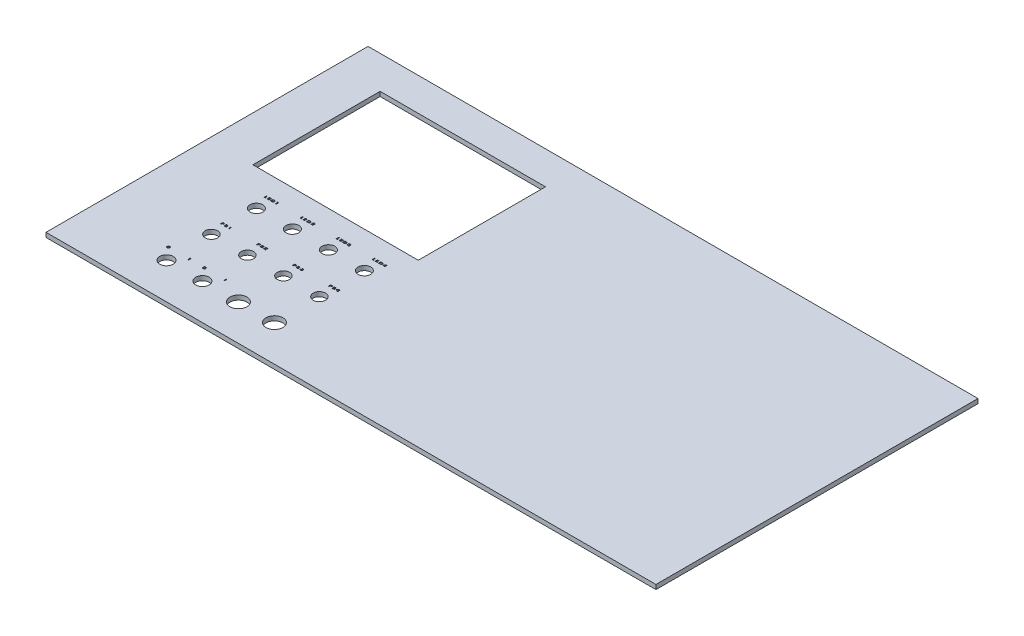
from build123d import *

# Parameters (mm, degrees)
SKETCH1_W           = 861.06
SKETCH1_H           = 454.66
BOSS_EXTRUDE1_DEPTH = 6.35
SKETCH3_W           = 233.426
SKETCH3_H           = 179.578
CUT_EXTRUDE2_DEPTH  = 974.745532313
SKETCH4_R           = 9.017
CUT_EXTRUDE3_DEPTH  = 974.745532313
SKETCH5_R           = 8.763
CUT_EXTRUDE4_DEPTH  = 974.745532313
SKETCH6_R           = 9.525
CUT_EXTRUDE5_DEPTH  = 974.745532313
SKETCH7_R           = 11.938
CUT_EXTRUDE6_DEPTH  = 974.745532313
CUT_EXTRUDE7_DEPTH  = 1.27


with BuildPart() as part:
    # Sketch1 → Boss-Extrude1 (new body)
    with BuildSketch(Plane(origin=(0, 0, 0), x_dir=(1, 0, 0), z_dir=(0, 1, 0))):
        with Locations((430.53, 227.33)):
            Rectangle(SKETCH1_W, SKETCH1_H)
    extrude(amount=BOSS_EXTRUDE1_DEPTH)

    # Sketch3 → Cut-Extrude2 (cut, through all)
    with BuildSketch(Plane(origin=(0, 6.35, 0), x_dir=(1, 0, 0), z_dir=(0, 1, 0))):
        with Locations((180.213, 318.389)):
            Rectangle(SKETCH3_W, SKETCH3_H)
    extrude(amount=-CUT_EXTRUDE2_DEPTH, mode=Mode.SUBTRACT)

    # Sketch4 → Cut-Extrude3 (cut, through all)
    with BuildSketch(Plane(origin=(0, 6.35, 0), x_dir=(1, 0, 0), z_dir=(0, 1, 0))):
        with Locations(Location((119.253, 177.8, 0), (0, 0, 270))):
            Circle(SKETCH4_R)
        with Locations(Location((170.053, 177.8, 0), (0, 0, 270))):
            Circle(SKETCH4_R)
        with Locations(Location((220.853, 177.8, 0), (0, 0, 270))):
            Circle(SKETCH4_R)
        with Locations(Location((271.653, 177.8, 0), (0, 0, 270))):
            Circle(SKETCH4_R)
    extrude(amount=-CUT_EXTRUDE3_DEPTH, mode=Mode.SUBTRACT)

    # Sketch5 → Cut-Extrude4 (cut, through all)
    with BuildSketch(Plane(origin=(0, 6.35, 0), x_dir=(1, 0, 0), z_dir=(0, 1, 0))):
        with Locations(Location((119.253, 114.3, 0), (0, 0, 270))):
            Circle(SKETCH5_R)
        with Locations(Location((170.053, 114.3, 0), (0, 0, 270))):
            Circle(SKETCH5_R)
        with Locations(Location((220.853, 114.3, 0), (0, 0, 270))):
            Circle(SKETCH5_R)
        with Locations(Location((271.653, 114.3, 0), (0, 0, 270))):
            Circle(SKETCH5_R)
    extrude(amount=-CUT_EXTRUDE4_DEPTH, mode=Mode.SUBTRACT)

    # Sketch6 → Cut-Extrude5 (cut, through all)
    with BuildSketch(Plane(origin=(0, 6.35, 0), x_dir=(1, 0, 0), z_dir=(0, 1, 0))):
        with Locations(Location((119.253, 50.8, 0), (0, 0, 270))):
            Circle(SKETCH6_R)
        with Locations(Location((170.053, 50.8, 0), (0, 0, 270))):
            Circle(SKETCH6_R)
    extrude(amount=-CUT_EXTRUDE5_DEPTH, mode=Mode.SUBTRACT)

    # Sketch7 → Cut-Extrude6 (cut, through all)
    with BuildSketch(Plane(origin=(0, 6.35, 0), x_dir=(1, 0, 0), z_dir=(0, 1, 0))):
        with Locations(Location((220.853, 50.8, 0), (0, 0, 270))):
            Circle(SKETCH7_R)
        with Locations(Location((271.653, 50.8, 0), (0, 0, 270))):
            Circle(SKETCH7_R)
    extrude(amount=-CUT_EXTRUDE6_DEPTH, mode=Mode.SUBTRACT)

    # Sketch8 → Cut-Extrude7 (cut)
    # profile 1 of 32: a face of its own
    with BuildSketch(Plane(origin=(0, 6.35, 0), x_dir=(1, 0, 0), z_dir=(0, 1, 0))):
        Polygon((111.073333333, 200.35), (112.060512821, 200.35), (112.060512821, 197.478205128), (113.496410256, 197.478205128), (113.496410256, 196.85), (111.073333333, 196.85), align=None)
    # profile 2 of 32: a face of its own
    with BuildSketch(Plane(origin=(0, 6.35, 0), x_dir=(1, 0, 0), z_dir=(0, 1, 0))):
        Polygon((115.237435897, 200.35), (118.064358974, 200.35), (118.064358974, 199.721794872), (116.224615385, 199.721794872), (116.224615385, 199.048717949), (118.064358974, 199.048717949), (118.064358974, 198.420512821), (116.224615385, 198.420512821), (116.224615385, 197.478205128), (118.064358974, 197.478205128), (118.064358974, 196.85), (115.237435897, 196.85), align=None)
    # profile 3 of 32: a face of its own
    with BuildSketch(Plane(origin=(0, 6.35, 0), x_dir=(1, 0, 0), z_dir=(0, 1, 0))):
        with BuildLine():
            Line((119.984871795, 200.35), (121.159250801, 200.35))
            add(Edge.make_bspline(
                [(121.159250801, 200.35), (121.250872761, 200.349566664), (121.428089202, 200.348728501), (121.684779261, 200.339356608), (121.923265866, 200.324941579), (122.143609118, 200.305028048), (122.345553138, 200.278844706), (122.529200643, 200.245912058), (122.69480494, 200.207850377), (122.844436106, 200.163619384), (122.981172584, 200.110976865), (123.110593172, 200.053263957), (123.233434171, 199.98677023), (123.35089371, 199.914339555), (123.46136754, 199.83297772), (123.565909254, 199.744734859), (123.664220668, 199.648860369), (123.756697648, 199.547082989), (123.840726497, 199.439310157), (123.913312526, 199.325495337), (123.975179635, 199.207595236), (124.026273323, 199.085056078), (124.064425966, 198.95752938), (124.092654922, 198.826057835), (124.109966404, 198.689971279), (124.112030194, 198.597713508), (124.113076923, 198.550921474)],
                knots=[0, 0, 0, 0, 1.693374386, 3.27534779, 4.746813147, 6.108942391, 7.36377171, 8.509323213, 9.556068542, 10.503127147, 11.390414953, 12.262344654, 13.120425789, 13.970247547, 14.810896929, 15.653796188, 16.496905721, 17.347111629, 18.193853914, 19.019452892, 19.838676493, 20.652094301, 21.469242615, 22.295282187, 23.135387591, 24, 24, 24, 24], degree=3))
            add(Edge.make_bspline(
                [(124.113076923, 198.550921474), (124.112689099, 198.51747157), (124.111922541, 198.451355698), (124.10122263, 198.353315593), (124.086259809, 198.257211816), (124.064373284, 198.163047407), (124.036330034, 198.070961008), (124.001674562, 197.980865046), (123.961255173, 197.892632818), (123.914114884, 197.807039547), (123.861243105, 197.724612612), (123.804917187, 197.644449131), (123.742785713, 197.568567217), (123.676041037, 197.496257495), (123.604664453, 197.427329419), (123.527618323, 197.363140887), (123.447316527, 197.300924123), (123.333013705, 197.224910887), (123.183663928, 197.139057638), (122.996011088, 197.052515499), (122.800774826, 196.983406159), (122.629764467, 196.94031936), (122.480896823, 196.913112618), (122.34995964, 196.897194762), (122.200613375, 196.882267486), (122.0322336, 196.870993276), (121.845044827, 196.860745478), (121.638841783, 196.855234506), (121.414012392, 196.850638286), (121.25787828, 196.850218201), (121.176778846, 196.85)],
                knots=[0, 0, 0, 0, 0.733563833, 1.449935774, 2.161446157, 2.866720635, 3.569081052, 4.271890573, 4.983160702, 5.696884989, 6.413843971, 7.130949637, 7.845318354, 8.563834332, 9.289161384, 10.020571367, 10.763113149, 11.516883971, 13.030630894, 14.538050439, 16.044728459, 17.568240811, 18.402058251, 19.363738217, 20.461257557, 21.69501578, 23.066022227, 24.574304971, 26.220619919, 28, 28, 28, 28], degree=3))
            Line((121.176778846, 196.85), (119.984871795, 196.85))
            Line((119.984871795, 196.85), (119.984871795, 200.35))
        make_face()
        with BuildLine():
            Line((120.972051282, 199.721794872), (120.972051282, 197.478205128))
            Line((120.972051282, 197.478205128), (121.434791667, 197.478205128))
            add(Edge.make_bspline(
                [(121.434791667, 197.478205128), (121.489721682, 197.478284601), (121.595874085, 197.478438184), (121.749168528, 197.484942613), (121.890958462, 197.49152841), (122.02064379, 197.504027844), (122.138963848, 197.517814097), (122.245174544, 197.537374932), (122.340421587, 197.557267072), (122.42453716, 197.583259418), (122.50136536, 197.612547542), (122.573282117, 197.646083528), (122.641839754, 197.684060901), (122.706360618, 197.726980099), (122.767515263, 197.774317074), (122.82601723, 197.82517762), (122.880140717, 197.88173881), (122.930216808, 197.942629719), (122.977090455, 198.006788155), (123.016661531, 198.075655754), (123.050931661, 198.147703575), (123.077894004, 198.223739618), (123.09990618, 198.303096942), (123.115195815, 198.386374477), (123.124480139, 198.473116305), (123.125420807, 198.532201437), (123.125897436, 198.562139423)],
                knots=[0, 0, 0, 0, 1.727146602, 3.337715469, 4.824472348, 6.189820039, 7.434109967, 8.568689564, 9.585046685, 10.491724395, 11.33385214, 12.168991953, 12.98489598, 13.796152835, 14.603170893, 15.415525547, 16.231561962, 17.061511701, 17.893638723, 18.726836047, 19.555320219, 20.399209907, 21.260364022, 22.142524227, 23.058831168, 24, 24, 24, 24], degree=3))
            add(Edge.make_bspline(
                [(123.125897436, 198.562139423), (123.124748219, 198.608048107), (123.122499605, 198.697875307), (123.099092404, 198.828457413), (123.062732685, 198.951376369), (123.012281215, 199.06691617), (122.945541971, 199.17340158), (122.864368123, 199.271678191), (122.769640295, 199.363162861), (122.696840482, 199.414911097), (122.659651442, 199.441346154)],
                knots=[0, 0, 0, 0, 1.058576283, 2.071262668, 3.050813316, 4.011969473, 4.971368377, 5.941023039, 6.948192697, 8, 8, 8, 8], degree=3))
            add(Edge.make_bspline(
                [(122.659651442, 199.441346154), (122.622524575, 199.464256018), (122.545361843, 199.5118708), (122.414823132, 199.567143531), (122.269648845, 199.616033949), (122.108027596, 199.654260858), (121.931060452, 199.685172458), (121.738086202, 199.70617777), (121.529407299, 199.71980554), (121.384801751, 199.721116608), (121.309991987, 199.721794872)],
                knots=[0, 0, 0, 0, 0.748851179, 1.556376991, 2.429009872, 3.379850958, 4.407384533, 5.51499452, 6.71441534, 8, 8, 8, 8], degree=3))
            Line((121.309991987, 199.721794872), (120.972051282, 199.721794872))
        make_face(mode=Mode.SUBTRACT)
    # profile 4 of 32: a face of its own
    with BuildSketch(Plane(origin=(0, 6.35, 0), x_dir=(1, 0, 0), z_dir=(0, 1, 0))):
        Polygon((126.609210737, 200.35), (128.097692308, 200.35), (128.097692308, 196.85), (127.110512821, 196.85), (127.110512821, 199.766666667), (126.033589744, 199.766666667), align=None)
    # profile 5 of 32: a face of its own
    with BuildSketch(Plane(origin=(0, 6.35, 0), x_dir=(1, 0, 0), z_dir=(0, 1, 0))):
        Polygon((161.873333333, 200.35), (162.860512821, 200.35), (162.860512821, 197.478205128), (164.296410256, 197.478205128), (164.296410256, 196.85), (161.873333333, 196.85), align=None)
    # profile 6 of 32: a face of its own
    with BuildSketch(Plane(origin=(0, 6.35, 0), x_dir=(1, 0, 0), z_dir=(0, 1, 0))):
        Polygon((166.037435897, 200.35), (168.864358974, 200.35), (168.864358974, 199.721794872), (167.024615385, 199.721794872), (167.024615385, 199.048717949), (168.864358974, 199.048717949), (168.864358974, 198.420512821), (167.024615385, 198.420512821), (167.024615385, 197.478205128), (168.864358974, 197.478205128), (168.864358974, 196.85), (166.037435897, 196.85), align=None)
    # profile 7 of 32: a face of its own
    with BuildSketch(Plane(origin=(0, 6.35, 0), x_dir=(1, 0, 0), z_dir=(0, 1, 0))):
        with BuildLine():
            Line((170.784871795, 200.35), (171.959250801, 200.35))
            add(Edge.make_bspline(
                [(171.959250801, 200.35), (172.050872761, 200.349566664), (172.228089202, 200.348728501), (172.484779261, 200.339356608), (172.723265866, 200.324941579), (172.943609118, 200.305028048), (173.145553138, 200.278844706), (173.329200643, 200.245912058), (173.49480494, 200.207850377), (173.644436106, 200.163619384), (173.781172584, 200.110976865), (173.910593172, 200.053263957), (174.033434171, 199.98677023), (174.15089371, 199.914339555), (174.26136754, 199.83297772), (174.365909254, 199.744734859), (174.464220668, 199.648860369), (174.556697648, 199.547082989), (174.640726497, 199.439310157), (174.713312526, 199.325495337), (174.775179635, 199.207595236), (174.826273323, 199.085056078), (174.864425966, 198.95752938), (174.892654922, 198.826057835), (174.909966404, 198.689971279), (174.912030194, 198.597713508), (174.913076923, 198.550921474)],
                knots=[0, 0, 0, 0, 1.693374386, 3.27534779, 4.746813147, 6.108942391, 7.36377171, 8.509323213, 9.556068542, 10.503127147, 11.390414953, 12.262344654, 13.120425789, 13.970247547, 14.810896929, 15.653796188, 16.496905721, 17.347111629, 18.193853914, 19.019452892, 19.838676493, 20.652094301, 21.469242615, 22.295282187, 23.135387591, 24, 24, 24, 24], degree=3))
            add(Edge.make_bspline(
                [(174.913076923, 198.550921474), (174.912689099, 198.51747157), (174.911922541, 198.451355698), (174.90122263, 198.353315593), (174.886259809, 198.257211816), (174.864373284, 198.163047407), (174.836330034, 198.070961008), (174.801674562, 197.980865046), (174.761255173, 197.892632818), (174.714114884, 197.807039547), (174.661243105, 197.724612612), (174.604917187, 197.644449131), (174.542785713, 197.568567217), (174.476041037, 197.496257495), (174.404664453, 197.427329419), (174.327618323, 197.363140887), (174.247316527, 197.300924123), (174.133013705, 197.224910887), (173.983663928, 197.139057638), (173.796011088, 197.052515499), (173.600774826, 196.983406159), (173.429764467, 196.94031936), (173.280896823, 196.913112618), (173.14995964, 196.897194762), (173.000613375, 196.882267486), (172.8322336, 196.870993276), (172.645044827, 196.860745478), (172.438841783, 196.855234506), (172.214012392, 196.850638286), (172.05787828, 196.850218201), (171.976778846, 196.85)],
                knots=[0, 0, 0, 0, 0.733563833, 1.449935774, 2.161446157, 2.866720635, 3.569081052, 4.271890573, 4.983160702, 5.696884989, 6.413843971, 7.130949637, 7.845318354, 8.563834332, 9.289161384, 10.020571367, 10.763113149, 11.516883971, 13.030630894, 14.538050439, 16.044728459, 17.568240811, 18.402058251, 19.363738217, 20.461257557, 21.69501578, 23.066022227, 24.574304971, 26.220619919, 28, 28, 28, 28], degree=3))
            Line((171.976778846, 196.85), (170.784871795, 196.85))
            Line((170.784871795, 196.85), (170.784871795, 200.35))
        make_face()
        with BuildLine():
            Line((171.772051282, 199.721794872), (171.772051282, 197.478205128))
            Line((171.772051282, 197.478205128), (172.234791667, 197.478205128))
            add(Edge.make_bspline(
                [(172.234791667, 197.478205128), (172.289721682, 197.478284601), (172.395874085, 197.478438184), (172.549168528, 197.484942613), (172.690958462, 197.49152841), (172.82064379, 197.504027844), (172.938963848, 197.517814097), (173.045174544, 197.537374932), (173.140421587, 197.557267072), (173.22453716, 197.583259418), (173.30136536, 197.612547542), (173.373282117, 197.646083528), (173.441839754, 197.684060901), (173.506360618, 197.726980099), (173.567515263, 197.774317074), (173.62601723, 197.82517762), (173.680140717, 197.88173881), (173.730216808, 197.942629719), (173.777090455, 198.006788155), (173.816661531, 198.075655754), (173.850931661, 198.147703575), (173.877894004, 198.223739618), (173.89990618, 198.303096942), (173.915195815, 198.386374477), (173.924480139, 198.473116305), (173.925420807, 198.532201437), (173.925897436, 198.562139423)],
                knots=[0, 0, 0, 0, 1.727146602, 3.337715469, 4.824472348, 6.189820039, 7.434109967, 8.568689564, 9.585046685, 10.491724395, 11.33385214, 12.168991953, 12.98489598, 13.796152835, 14.603170893, 15.415525547, 16.231561962, 17.061511701, 17.893638723, 18.726836047, 19.555320219, 20.399209907, 21.260364022, 22.142524227, 23.058831168, 24, 24, 24, 24], degree=3))
            add(Edge.make_bspline(
                [(173.925897436, 198.562139423), (173.924748219, 198.608048107), (173.922499605, 198.697875307), (173.899092404, 198.828457413), (173.862732685, 198.951376369), (173.812281215, 199.06691617), (173.745541971, 199.17340158), (173.664368123, 199.271678191), (173.569640295, 199.363162861), (173.496840482, 199.414911097), (173.459651442, 199.441346154)],
                knots=[0, 0, 0, 0, 1.058576283, 2.071262668, 3.050813316, 4.011969473, 4.971368377, 5.941023039, 6.948192697, 8, 8, 8, 8], degree=3))
            add(Edge.make_bspline(
                [(173.459651442, 199.441346154), (173.422524575, 199.464256018), (173.345361843, 199.5118708), (173.214823132, 199.567143531), (173.069648845, 199.616033949), (172.908027596, 199.654260858), (172.731060452, 199.685172458), (172.538086202, 199.70617777), (172.329407299, 199.71980554), (172.184801751, 199.721116608), (172.109991987, 199.721794872)],
                knots=[0, 0, 0, 0, 0.748851179, 1.556376991, 2.429009872, 3.379850958, 4.407384533, 5.51499452, 6.71441534, 8, 8, 8, 8], degree=3))
            Line((172.109991987, 199.721794872), (171.772051282, 199.721794872))
        make_face(mode=Mode.SUBTRACT)
    # profile 8 of 32: a face of its own
    with BuildSketch(Plane(origin=(0, 6.35, 0), x_dir=(1, 0, 0), z_dir=(0, 1, 0))):
        with BuildLine():
            Line((177.506666667, 199.183333333), (176.519487179, 199.183333333))
            add(Edge.make_bspline(
                [(176.519487179, 199.183333333), (176.524084963, 199.230921295), (176.53310829, 199.324314512), (176.563708095, 199.459841989), (176.607955047, 199.587640635), (176.666271336, 199.707685779), (176.739611909, 199.819128032), (176.825270889, 199.923660756), (176.925974376, 200.019358401), (177.039476894, 200.106605588), (177.164251313, 200.184536802), (177.297777869, 200.253924216), (177.440569133, 200.310966456), (177.591589342, 200.357981969), (177.750840357, 200.39541761), (177.919002132, 200.420482112), (178.095258455, 200.437501326), (178.215692044, 200.438985564), (178.277199519, 200.43974359)],
                knots=[0, 0, 0, 0, 0.956037611, 1.876260833, 2.772605913, 3.657394591, 4.539509213, 5.436561718, 6.356154809, 7.313152894, 8.296741356, 9.296607539, 10.32056539, 11.369344437, 12.459570599, 13.590682535, 14.76952074, 16, 16, 16, 16], degree=3))
            add(Edge.make_bspline(
                [(178.277199519, 200.43974359), (178.315536038, 200.43935002), (178.391093548, 200.438574333), (178.502667357, 200.432127996), (178.610721604, 200.421627658), (178.715409743, 200.407274176), (178.816294276, 200.387149703), (178.914325453, 200.36447923), (179.008449907, 200.336210242), (179.099369745, 200.304773024), (179.18628885, 200.269113481), (179.268897655, 200.229230347), (179.347009405, 200.18554747), (179.420995266, 200.138599117), (179.490329711, 200.087506068), (179.554977357, 200.03245549), (179.615777544, 199.97446181), (179.670327048, 199.911991642), (179.720945478, 199.848900182), (179.764783318, 199.784284692), (179.800667389, 199.71877098), (179.832671578, 199.654385201), (179.855476563, 199.588500902), (179.87260443, 199.522683426), (179.882628972, 199.456375376), (179.884126573, 199.412164213), (179.884871795, 199.390164263)],
                knots=[0, 0, 0, 0, 1.305773114, 2.57355042, 3.805299843, 5.003166888, 6.170977339, 7.308271283, 8.429147933, 9.516767106, 10.584124427, 11.627340595, 12.639477076, 13.631023648, 14.610222032, 15.570402507, 16.521864285, 17.469220959, 18.392970856, 19.276142198, 20.124358359, 20.936193589, 21.721765795, 22.494076729, 23.250636402, 24, 24, 24, 24], degree=3))
            add(Edge.make_bspline(
                [(179.884871795, 199.390164263), (179.884009028, 199.363476592), (179.882267684, 199.309612197), (179.869546661, 199.228236123), (179.850093429, 199.145337663), (179.821707329, 199.060952798), (179.78493124, 198.975377092), (179.740330437, 198.888221556), (179.688668752, 198.799166009), (179.627579813, 198.708503611), (179.555770126, 198.615248452), (179.472443695, 198.517473451), (179.374300208, 198.41713334), (179.263844776, 198.311498514), (179.139953773, 198.202022793), (179.002740495, 198.088111883), (178.852073942, 197.970708303), (178.746190121, 197.892336603), (178.6915625, 197.851903045)],
                knots=[0, 0, 0, 0, 0.636129666, 1.283916433, 1.959714468, 2.664569988, 3.403576632, 4.178617281, 4.997680171, 5.8569826, 6.783153769, 7.802791294, 8.918059507, 10.128034395, 11.446439279, 12.859109809, 14.379550725, 16, 16, 16, 16], degree=3))
            Line((178.6915625, 197.851903045), (178.123653846, 197.433333333))
            Line((178.123653846, 197.433333333), (179.92974359, 197.433333333))
            Line((179.92974359, 197.433333333), (179.92974359, 196.85))
            Line((179.92974359, 196.85), (176.384871795, 196.85))
            Line((176.384871795, 196.85), (176.384871795, 197.168309295))
            Line((176.384871795, 197.168309295), (177.95328125, 198.271173878))
            add(Edge.make_bspline(
                [(177.95328125, 198.271173878), (177.998722156, 198.303283724), (178.086346514, 198.365201605), (178.210972633, 198.456699666), (178.323694549, 198.543579873), (178.423612995, 198.626608375), (178.513068216, 198.703052884), (178.589917383, 198.775707638), (178.655147911, 198.842983771), (178.708885448, 198.906759295), (178.753663343, 198.967066485), (178.791677808, 199.025466304), (178.824067082, 199.082321115), (178.851078152, 199.13762927), (178.871514052, 199.191928768), (178.886190157, 199.244471177), (178.896214965, 199.295599945), (178.897204551, 199.32935571), (178.897692308, 199.34599359)],
                knots=[0, 0, 0, 0, 1.80896824, 3.488259695, 5.026346342, 6.435066536, 7.71169278, 8.851183385, 9.872242404, 10.756587062, 11.56049936, 12.312883826, 13.020667955, 13.68676569, 14.31195329, 14.903742748, 15.459665749, 16, 16, 16, 16], degree=3))
            add(Edge.make_bspline(
                [(178.897692308, 199.34599359), (178.897216117, 199.362396813), (178.896269732, 199.394996752), (178.886804298, 199.442586549), (178.871957966, 199.488015583), (178.851506152, 199.531318074), (178.824471686, 199.572235427), (178.791455834, 199.610820959), (178.752115824, 199.646590688), (178.708450729, 199.680972083), (178.659593171, 199.711340011), (178.607052363, 199.738249415), (178.5513814, 199.761469146), (178.49179402, 199.779318191), (178.42942939, 199.794575546), (178.363400411, 199.803639803), (178.294170112, 199.810509038), (178.246836874, 199.811189016), (178.222512019, 199.811538462)],
                knots=[0, 0, 0, 0, 0.862927638, 1.71499152, 2.543988277, 3.375265886, 4.22866202, 5.119062327, 6.042203892, 7.024490353, 8.042072477, 9.065887479, 10.130962887, 11.213179919, 12.338622969, 13.508285038, 14.71949171, 16, 16, 16, 16], degree=3))
            add(Edge.make_bspline(
                [(178.222512019, 199.811538462), (178.197956127, 199.810945279), (178.149657352, 199.809778553), (178.078772963, 199.802216687), (178.01110472, 199.788605006), (177.946395649, 199.770732204), (177.884934359, 199.746603973), (177.826746512, 199.717192035), (177.771791822, 199.682430876), (177.719846649, 199.643663076), (177.673118677, 199.599419838), (177.631245736, 199.551494019), (177.595411695, 199.499551424), (177.565702918, 199.443491042), (177.541989706, 199.383714421), (177.52359175, 199.320386854), (177.511623867, 199.25314179), (177.508346069, 199.206983074), (177.506666667, 199.183333333)],
                knots=[0, 0, 0, 0, 1.109013707, 2.181309585, 3.21418384, 4.223217855, 5.209078266, 6.190862516, 7.163069267, 8.14252479, 9.113183485, 10.063370779, 11.011915367, 11.956222732, 12.922452981, 13.911190504, 14.929783829, 16, 16, 16, 16], degree=3))
        make_face()
    # profile 9 of 32: a face of its own
    with BuildSketch(Plane(origin=(0, 6.35, 0), x_dir=(1, 0, 0), z_dir=(0, 1, 0))):
        with BuildLine():
            Line((112.851333333, 136.85), (113.903717147, 136.85))
            add(Edge.make_bspline(
                [(113.903717147, 136.85), (113.972429737, 136.849799194), (114.104732734, 136.849412552), (114.295721552, 136.844572766), (114.471722694, 136.836059616), (114.63309086, 136.825347975), (114.779660954, 136.810512256), (114.911440351, 136.793542874), (115.02827325, 136.772778779), (115.131734234, 136.748039637), (115.225098147, 136.719159078), (115.312634486, 136.688208114), (115.394220384, 136.651055647), (115.472129023, 136.612621866), (115.543554176, 136.56755432), (115.611225443, 136.520470283), (115.673145958, 136.468114808), (115.729931001, 136.412143333), (115.78097438, 136.352914714), (115.825662339, 136.290573515), (115.863818819, 136.225571055), (115.893865626, 136.156871959), (115.917758037, 136.085778964), (115.935747895, 136.011753158), (115.945253503, 135.934585064), (115.94673771, 135.88224106), (115.947487179, 135.855809295)],
                knots=[0, 0, 0, 0, 1.946728274, 3.748337642, 5.412200171, 6.938796113, 8.329630926, 9.585406812, 10.702359772, 11.69003228, 12.596966834, 13.470410824, 14.318179131, 15.135482783, 15.929302113, 16.70826363, 17.469577399, 18.22339663, 18.96528578, 19.681894402, 20.393961265, 21.096513435, 21.802147877, 22.516826711, 23.251052922, 24, 24, 24, 24], degree=3))
            add(Edge.make_bspline(
                [(115.947487179, 135.855809295), (115.946754155, 135.826543934), (115.945309479, 135.768866557), (115.931629341, 135.684395514), (115.909179868, 135.603652048), (115.877181962, 135.526933287), (115.837292073, 135.453453816), (115.787450535, 135.384372848), (115.729153035, 135.318802603), (115.66125241, 135.258427462), (115.587192357, 135.200591995), (115.505673334, 135.148435378), (115.418081836, 135.100378307), (115.324015583, 135.057139368), (115.223552126, 135.017919548), (115.116883157, 134.982856532), (115.00383908, 134.952538894), (114.925816687, 134.936906244), (114.885988782, 134.928926282)],
                knots=[0, 0, 0, 0, 0.913699387, 1.800756288, 2.665261459, 3.526244706, 4.392136167, 5.271437, 6.18154126, 7.12746094, 8.105929228, 9.114471613, 10.147015659, 11.22502329, 12.346296715, 13.51457821, 14.731272665, 16, 16, 16, 16], degree=3))
            add(Edge.make_bspline(
                [(114.885988782, 134.928926282), (114.859617044, 134.924455005), (114.802169096, 134.914714817), (114.708012817, 134.905012814), (114.599323649, 134.895915194), (114.475673353, 134.888157603), (114.337271914, 134.882948942), (114.183951705, 134.878775782), (114.016141743, 134.875809133), (113.899278087, 134.875698534), (113.838512821, 134.875641026)],
                knots=[0, 0, 0, 0, 0.611312755, 1.331678009, 2.162671672, 3.104784941, 4.163461421, 5.328565698, 6.610941828, 8, 8, 8, 8], degree=3))
            Line((113.838512821, 134.875641026), (113.838512821, 133.35))
            Line((113.838512821, 133.35), (112.851333333, 133.35))
            Line((112.851333333, 133.35), (112.851333333, 136.85))
        make_face()
        with BuildLine():
            Line((113.838512821, 135.503846154), (114.147707532, 135.503846154))
            add(Edge.make_bspline(
                [(114.147707532, 135.503846154), (114.17692127, 135.504037047), (114.233014852, 135.504403584), (114.313659737, 135.505611427), (114.38753837, 135.508314372), (114.454367471, 135.512662864), (114.514502825, 135.517248566), (114.567313368, 135.523644671), (114.613482949, 135.530375492), (114.664629787, 135.541275821), (114.720754486, 135.55880603), (114.781056495, 135.585541615), (114.834104022, 135.617510588), (114.879003461, 135.655775116), (114.915116565, 135.699313734), (114.941667302, 135.74772241), (114.957818881, 135.800810714), (114.959467258, 135.837701463), (114.960307692, 135.856510417)],
                knots=[0, 0, 0, 0, 1.422534539, 2.731422333, 3.927179836, 5.021783057, 5.992350141, 6.863266647, 7.611663522, 8.263405706, 9.40797824, 10.467533011, 11.468771286, 12.413029741, 13.326617707, 14.207587563, 15.086128575, 16, 16, 16, 16], degree=3))
            add(Edge.make_bspline(
                [(114.960307692, 135.856510417), (114.959656925, 135.872922306), (114.958387569, 135.904934587), (114.947778892, 135.951355734), (114.92895776, 135.994023367), (114.903766151, 136.033622306), (114.870729604, 136.069116547), (114.830711237, 136.100611525), (114.784321285, 136.130007847), (114.749296209, 136.14471719), (114.731040865, 136.152383814)],
                knots=[0, 0, 0, 0, 0.983386196, 1.918148081, 2.834452621, 3.767322061, 4.7193592, 5.726031039, 6.814789588, 8, 8, 8, 8], degree=3))
            add(Edge.make_bspline(
                [(114.731040865, 136.152383814), (114.715702051, 136.158029651), (114.682691427, 136.170180042), (114.62721336, 136.183790077), (114.563260599, 136.195336854), (114.490270327, 136.205191146), (114.408624913, 136.212568699), (114.317921744, 136.218366682), (114.21829778, 136.220655791), (114.148876155, 136.221404296), (114.112651442, 136.221794872)],
                knots=[0, 0, 0, 0, 0.627014203, 1.349395672, 2.188707916, 3.121226466, 4.175472397, 5.334965939, 6.609365681, 8, 8, 8, 8], degree=3))
            Line((114.112651442, 136.221794872), (113.838512821, 136.221794872))
            Line((113.838512821, 136.221794872), (113.838512821, 135.503846154))
        make_face(mode=Mode.SUBTRACT)
    # profile 10 of 32: a face of its own
    with BuildSketch(Plane(origin=(0, 6.35, 0), x_dir=(1, 0, 0), z_dir=(0, 1, 0))):
        with BuildLine():
            Line((117.868, 133.35), (117.868, 136.85))
            Line((117.868, 136.85), (118.684105769, 136.85))
            add(Edge.make_bspline(
                [(118.684105769, 136.85), (118.741366634, 136.850011414), (118.851693869, 136.850033406), (119.011320622, 136.846114403), (119.158794408, 136.841259869), (119.294662155, 136.835536847), (119.418504443, 136.826052696), (119.530537634, 136.81595042), (119.630690196, 136.803653442), (119.693056603, 136.792744543), (119.722467147, 136.78760016)],
                knots=[0, 0, 0, 0, 1.31948929, 2.542322856, 3.679315054, 4.719870347, 5.675693744, 6.541172342, 7.312050872, 8, 8, 8, 8], degree=3))
            add(Edge.make_bspline(
                [(119.722467147, 136.78760016), (119.760422782, 136.780320021), (119.834906776, 136.766033504), (119.942701613, 136.737713914), (120.044570631, 136.705622142), (120.140469185, 136.669176959), (120.23047093, 136.627801108), (120.314556443, 136.581589506), (120.392682255, 136.531092991), (120.464183528, 136.476465588), (120.528718864, 136.418588102), (120.585082717, 136.357720284), (120.632479545, 136.293837715), (120.672268073, 136.227970123), (120.702656554, 136.158896147), (120.723440753, 136.087164071), (120.737698028, 136.013190102), (120.739090634, 135.962681496), (120.739794872, 135.937139423)],
                knots=[0, 0, 0, 0, 1.288638081, 2.528818454, 3.714528151, 4.849421997, 5.948001761, 7.015476048, 8.046736511, 9.047591826, 10.013384564, 10.934618588, 11.80916513, 12.662011224, 13.496166577, 14.3174033, 15.149115171, 16, 16, 16, 16], degree=3))
            add(Edge.make_bspline(
                [(120.739794872, 135.937139423), (120.738130189, 135.904277953), (120.734824729, 135.839026924), (120.709586142, 135.74346014), (120.666253914, 135.653437517), (120.607154607, 135.567147642), (120.528427736, 135.48540156), (120.429878635, 135.407061411), (120.310546073, 135.331517743), (120.222078969, 135.286446111), (120.175391827, 135.262660256)],
                knots=[0, 0, 0, 0, 0.846570316, 1.680983366, 2.527232041, 3.411263011, 4.365891141, 5.441371359, 6.649723432, 8, 8, 8, 8], degree=3))
            add(Edge.make_bspline(
                [(120.175391827, 135.262660256), (120.214059367, 135.250113987), (120.28931234, 135.225697021), (120.397173049, 135.185040156), (120.497256441, 135.142383523), (120.589030147, 135.096971776), (120.672776028, 135.049115885), (120.748967714, 134.999723506), (120.816414806, 134.946799541), (120.876466371, 134.892180705), (120.928723794, 134.83469276), (120.974857049, 134.775399376), (121.012397147, 134.712342812), (121.044801583, 134.647824752), (121.068159821, 134.579967571), (121.08606753, 134.510174061), (121.096810894, 134.43753856), (121.098110238, 134.388162989), (121.098769231, 134.363120994)],
                knots=[0, 0, 0, 0, 1.404636823, 2.733638992, 3.981780949, 5.162825121, 6.269721482, 7.313539045, 8.297398225, 9.229093884, 10.115148496, 10.979328281, 11.820057026, 12.647176798, 13.469670561, 14.294302631, 15.134914998, 16, 16, 16, 16], degree=3))
            add(Edge.make_bspline(
                [(121.098769231, 134.363120994), (121.098106576, 134.339009411), (121.096787779, 134.291023221), (121.085811089, 134.219869459), (121.06848068, 134.150269792), (121.0433042, 134.082378531), (121.012354309, 134.015631262), (120.971885269, 133.951762949), (120.926758265, 133.888365435), (120.873995439, 133.827776469), (120.815954657, 133.769880389), (120.753704236, 133.715238672), (120.687310856, 133.664585528), (120.617152492, 133.617197544), (120.541979471, 133.574904893), (120.463358893, 133.535601704), (120.380983502, 133.499383386), (120.293281004, 133.467940348), (120.199584706, 133.439455839), (120.097767725, 133.416197326), (119.988258389, 133.394641565), (119.869662072, 133.379416845), (119.7430291, 133.365600325), (119.607809017, 133.357059311), (119.464271896, 133.351235268), (119.365836386, 133.350420056), (119.315115385, 133.35)],
                knots=[0, 0, 0, 0, 0.763234275, 1.518967293, 2.274700312, 3.030976776, 3.808996623, 4.599830996, 5.421511535, 6.271665876, 7.140431499, 8.016324575, 8.892686587, 9.783586145, 10.69518197, 11.621974588, 12.56662274, 13.542952754, 14.570884772, 15.665980933, 16.849012928, 18.104034293, 19.451034968, 20.882727707, 22.393758769, 24, 24, 24, 24], degree=3))
            Line((119.315115385, 133.35), (117.868, 133.35))
        make_face()
        with BuildLine():
            Line((118.855179487, 136.221794872), (118.855179487, 135.458974359))
            Line((118.855179487, 135.458974359), (119.064113782, 135.458974359))
            add(Edge.make_bspline(
                [(119.064113782, 135.458974359), (119.092400988, 135.459162026), (119.1469189, 135.459523715), (119.226000274, 135.464579188), (119.299320254, 135.472600736), (119.367107551, 135.484857896), (119.429396824, 135.498971983), (119.48610754, 135.517443437), (119.537132894, 135.538820042), (119.582580211, 135.563704346), (119.622733823, 135.590889742), (119.657647261, 135.621057466), (119.685998453, 135.654631592), (119.711618186, 135.688660376), (119.729620342, 135.726752048), (119.743159246, 135.766695403), (119.750877984, 135.80924381), (119.752029673, 135.838252127), (119.752615385, 135.853004808)],
                knots=[0, 0, 0, 0, 1.531470513, 2.951601988, 4.289032099, 5.522818593, 6.680046859, 7.744576757, 8.7482429, 9.671368044, 10.545391607, 11.370400094, 12.159694004, 12.921734149, 13.668811109, 14.429168115, 15.201126318, 16, 16, 16, 16], degree=3))
            add(Edge.make_bspline(
                [(119.752615385, 135.853004808), (119.751957424, 135.866811843), (119.750666533, 135.893900678), (119.74404975, 135.93352569), (119.730720327, 135.97053027), (119.713666735, 136.005969004), (119.689520817, 136.038070132), (119.662551477, 136.069595466), (119.628883001, 136.097337707), (119.591054704, 136.123470362), (119.547941582, 136.146517806), (119.499849756, 136.166911485), (119.446427737, 136.184451452), (119.387522985, 136.198251422), (119.323521113, 136.208516655), (119.254496231, 136.216134433), (119.180109534, 136.22125913), (119.128626132, 136.221612131), (119.101974359, 136.221794872)],
                knots=[0, 0, 0, 0, 0.794923146, 1.559606406, 2.299305798, 3.050759689, 3.811771406, 4.602135162, 5.431762038, 6.311701388, 7.243988896, 8.237728068, 9.313205348, 10.473932854, 11.713699693, 13.039329106, 14.467328779, 16, 16, 16, 16], degree=3))
            Line((119.101974359, 136.221794872), (118.855179487, 136.221794872))
        make_face(mode=Mode.SUBTRACT)
        with BuildLine():
            Line((118.855179487, 134.875641026), (118.855179487, 133.978205128))
            Line((118.855179487, 133.978205128), (119.096365385, 133.978205128))
            add(Edge.make_bspline(
                [(119.096365385, 133.978205128), (119.144279294, 133.978400965), (119.235928568, 133.978775559), (119.367346569, 133.98358937), (119.486577272, 133.992053168), (119.593779453, 134.002773262), (119.688864459, 134.017251832), (119.77153967, 134.035292668), (119.842404961, 134.055817281), (119.90197048, 134.080514283), (119.951512556, 134.109199995), (119.994560308, 134.139368173), (120.030743234, 134.173310875), (120.060246659, 134.210417316), (120.083364497, 134.250554556), (120.099373832, 134.293691216), (120.109545259, 134.339751106), (120.110899299, 134.37148081), (120.111589744, 134.387660256)],
                knots=[0, 0, 0, 0, 1.900664809, 3.635573708, 5.215581466, 6.641794037, 7.908444062, 9.028674666, 9.996605344, 10.831724618, 11.579184148, 12.263551699, 12.912859337, 13.539807459, 14.137775083, 14.742176496, 15.358617136, 16, 16, 16, 16], degree=3))
            add(Edge.make_bspline(
                [(120.111589744, 134.387660256), (120.11108876, 134.406202214), (120.110107239, 134.442529425), (120.097245018, 134.495079623), (120.078427663, 134.544842574), (120.051490411, 134.591512285), (120.016428364, 134.63468135), (119.973889676, 134.674820961), (119.923629097, 134.711965636), (119.865741555, 134.746461887), (119.798988798, 134.777706967), (119.722257167, 134.803837905), (119.635746594, 134.826160025), (119.539162923, 134.843917979), (119.43255093, 134.858964396), (119.315466047, 134.867908566), (119.188524163, 134.874633875), (119.100582653, 134.875297199), (119.054999199, 134.875641026)],
                knots=[0, 0, 0, 0, 0.690419058, 1.352661837, 2.007046633, 2.671296647, 3.353736276, 4.075560012, 4.848333838, 5.681504583, 6.586748777, 7.593567271, 8.702088903, 9.918335251, 11.256676684, 12.718365048, 14.299002886, 16, 16, 16, 16], degree=3))
            Line((119.054999199, 134.875641026), (118.855179487, 134.875641026))
        make_face(mode=Mode.SUBTRACT)
    # profile 11 of 32: a face of its own
    with BuildSketch(Plane(origin=(0, 6.35, 0), x_dir=(1, 0, 0), z_dir=(0, 1, 0))):
        Polygon((123.594903045, 136.85), (125.083384615, 136.85), (125.083384615, 133.35), (124.096205128, 133.35), (124.096205128, 136.266666667), (123.019282051, 136.266666667), align=None)
    # profile 12 of 32: a face of its own
    with BuildSketch(Plane(origin=(0, 6.35, 0), x_dir=(1, 0, 0), z_dir=(0, 1, 0))):
        Polygon((212.673333333, 200.35), (213.660512821, 200.35), (213.660512821, 197.478205128), (215.096410256, 197.478205128), (215.096410256, 196.85), (212.673333333, 196.85), align=None)
    # profile 13 of 32: a face of its own
    with BuildSketch(Plane(origin=(0, 6.35, 0), x_dir=(1, 0, 0), z_dir=(0, 1, 0))):
        Polygon((216.837435897, 200.35), (219.664358974, 200.35), (219.664358974, 199.721794872), (217.824615385, 199.721794872), (217.824615385, 199.048717949), (219.664358974, 199.048717949), (219.664358974, 198.420512821), (217.824615385, 198.420512821), (217.824615385, 197.478205128), (219.664358974, 197.478205128), (219.664358974, 196.85), (216.837435897, 196.85), align=None)
    # profile 14 of 32: a face of its own
    with BuildSketch(Plane(origin=(0, 6.35, 0), x_dir=(1, 0, 0), z_dir=(0, 1, 0))):
        with BuildLine():
            Line((221.584871795, 200.35), (222.759250801, 200.35))
            add(Edge.make_bspline(
                [(222.759250801, 200.35), (222.850872761, 200.349566664), (223.028089202, 200.348728501), (223.284779261, 200.339356608), (223.523265866, 200.324941579), (223.743609118, 200.305028048), (223.945553138, 200.278844706), (224.129200643, 200.245912058), (224.29480494, 200.207850377), (224.444436106, 200.163619384), (224.581172584, 200.110976865), (224.710593172, 200.053263957), (224.833434171, 199.98677023), (224.95089371, 199.914339555), (225.06136754, 199.83297772), (225.165909254, 199.744734859), (225.264220668, 199.648860369), (225.356697648, 199.547082989), (225.440726497, 199.439310157), (225.513312526, 199.325495337), (225.575179635, 199.207595236), (225.626273323, 199.085056078), (225.664425966, 198.95752938), (225.692654922, 198.826057835), (225.709966404, 198.689971279), (225.712030194, 198.597713508), (225.713076923, 198.550921474)],
                knots=[0, 0, 0, 0, 1.693374386, 3.27534779, 4.746813147, 6.108942391, 7.36377171, 8.509323213, 9.556068542, 10.503127147, 11.390414953, 12.262344654, 13.120425789, 13.970247547, 14.810896929, 15.653796188, 16.496905721, 17.347111629, 18.193853914, 19.019452892, 19.838676493, 20.652094301, 21.469242615, 22.295282187, 23.135387591, 24, 24, 24, 24], degree=3))
            add(Edge.make_bspline(
                [(225.713076923, 198.550921474), (225.712689099, 198.51747157), (225.711922541, 198.451355698), (225.70122263, 198.353315593), (225.686259809, 198.257211816), (225.664373284, 198.163047407), (225.636330034, 198.070961008), (225.601674562, 197.980865046), (225.561255173, 197.892632818), (225.514114884, 197.807039547), (225.461243105, 197.724612612), (225.404917187, 197.644449131), (225.342785713, 197.568567217), (225.276041037, 197.496257495), (225.204664453, 197.427329419), (225.127618323, 197.363140887), (225.047316527, 197.300924123), (224.933013705, 197.224910887), (224.783663928, 197.139057638), (224.596011088, 197.052515499), (224.400774826, 196.983406159), (224.229764467, 196.94031936), (224.080896823, 196.913112618), (223.94995964, 196.897194762), (223.800613375, 196.882267486), (223.6322336, 196.870993276), (223.445044827, 196.860745478), (223.238841783, 196.855234506), (223.014012392, 196.850638286), (222.85787828, 196.850218201), (222.776778846, 196.85)],
                knots=[0, 0, 0, 0, 0.733563833, 1.449935774, 2.161446157, 2.866720635, 3.569081052, 4.271890573, 4.983160702, 5.696884989, 6.413843971, 7.130949637, 7.845318354, 8.563834332, 9.289161384, 10.020571367, 10.763113149, 11.516883971, 13.030630894, 14.538050439, 16.044728459, 17.568240811, 18.402058251, 19.363738217, 20.461257557, 21.69501578, 23.066022227, 24.574304971, 26.220619919, 28, 28, 28, 28], degree=3))
            Line((222.776778846, 196.85), (221.584871795, 196.85))
            Line((221.584871795, 196.85), (221.584871795, 200.35))
        make_face()
        with BuildLine():
            Line((222.572051282, 199.721794872), (222.572051282, 197.478205128))
            Line((222.572051282, 197.478205128), (223.034791667, 197.478205128))
            add(Edge.make_bspline(
                [(223.034791667, 197.478205128), (223.089721682, 197.478284601), (223.195874085, 197.478438184), (223.349168528, 197.484942613), (223.490958462, 197.49152841), (223.62064379, 197.504027844), (223.738963848, 197.517814097), (223.845174544, 197.537374932), (223.940421587, 197.557267072), (224.02453716, 197.583259418), (224.10136536, 197.612547542), (224.173282117, 197.646083528), (224.241839754, 197.684060901), (224.306360618, 197.726980099), (224.367515263, 197.774317074), (224.42601723, 197.82517762), (224.480140717, 197.88173881), (224.530216808, 197.942629719), (224.577090455, 198.006788155), (224.616661531, 198.075655754), (224.650931661, 198.147703575), (224.677894004, 198.223739618), (224.69990618, 198.303096942), (224.715195815, 198.386374477), (224.724480139, 198.473116305), (224.725420807, 198.532201437), (224.725897436, 198.562139423)],
                knots=[0, 0, 0, 0, 1.727146602, 3.337715469, 4.824472348, 6.189820039, 7.434109967, 8.568689564, 9.585046685, 10.491724395, 11.33385214, 12.168991953, 12.98489598, 13.796152835, 14.603170893, 15.415525547, 16.231561962, 17.061511701, 17.893638723, 18.726836047, 19.555320219, 20.399209907, 21.260364022, 22.142524227, 23.058831168, 24, 24, 24, 24], degree=3))
            add(Edge.make_bspline(
                [(224.725897436, 198.562139423), (224.724748219, 198.608048107), (224.722499605, 198.697875307), (224.699092404, 198.828457413), (224.662732685, 198.951376369), (224.612281215, 199.06691617), (224.545541971, 199.17340158), (224.464368123, 199.271678191), (224.369640295, 199.363162861), (224.296840482, 199.414911097), (224.259651442, 199.441346154)],
                knots=[0, 0, 0, 0, 1.058576283, 2.071262668, 3.050813316, 4.011969473, 4.971368377, 5.941023039, 6.948192697, 8, 8, 8, 8], degree=3))
            add(Edge.make_bspline(
                [(224.259651442, 199.441346154), (224.222524575, 199.464256018), (224.145361843, 199.5118708), (224.014823132, 199.567143531), (223.869648845, 199.616033949), (223.708027596, 199.654260858), (223.531060452, 199.685172458), (223.338086202, 199.70617777), (223.129407299, 199.71980554), (222.984801751, 199.721116608), (222.909991987, 199.721794872)],
                knots=[0, 0, 0, 0, 0.748851179, 1.556376991, 2.429009872, 3.379850958, 4.407384533, 5.51499452, 6.71441534, 8, 8, 8, 8], degree=3))
            Line((222.909991987, 199.721794872), (222.572051282, 199.721794872))
        make_face(mode=Mode.SUBTRACT)
    # profile 15 of 32: a face of its own
    with BuildSketch(Plane(origin=(0, 6.35, 0), x_dir=(1, 0, 0), z_dir=(0, 1, 0))):
        with BuildLine():
            Line((228.486153846, 199.497435897), (227.498974359, 199.497435897))
            add(Edge.make_bspline(
                [(227.498974359, 199.497435897), (227.506106262, 199.528907759), (227.520184152, 199.591031065), (227.55122129, 199.680753872), (227.591409092, 199.765276007), (227.640330478, 199.844786698), (227.696445904, 199.920282188), (227.761482372, 199.990800128), (227.83520328, 200.056109074), (227.889367266, 200.094797605), (227.916842949, 200.114423077)],
                knots=[0, 0, 0, 0, 1.011192537, 1.996024987, 2.969452056, 3.939591863, 4.918518874, 5.914167876, 6.941923119, 8, 8, 8, 8], degree=3))
            add(Edge.make_bspline(
                [(227.916842949, 200.114423077), (227.957511271, 200.140696963), (228.039295249, 200.193533737), (228.171550575, 200.258792567), (228.31058742, 200.315362457), (228.45781528, 200.360578213), (228.612166449, 200.39650812), (228.774374252, 200.421300152), (228.9441316, 200.437272753), (229.060101495, 200.438908875), (229.119266827, 200.43974359)],
                knots=[0, 0, 0, 0, 0.918315468, 1.846731985, 2.794020963, 3.764924249, 4.766699646, 5.799376952, 6.877289709, 8, 8, 8, 8], degree=3))
            add(Edge.make_bspline(
                [(229.119266827, 200.43974359), (229.172107148, 200.438948408), (229.275606924, 200.437390862), (229.427646148, 200.424807369), (229.572922799, 200.402722945), (229.712318531, 200.373912062), (229.844730962, 200.334974075), (229.971131558, 200.288961837), (230.090449654, 200.233470029), (230.201799515, 200.169984188), (230.303624655, 200.101455243), (230.393092878, 200.028714064), (230.469053052, 199.952550594), (230.531666967, 199.87313429), (230.579753598, 199.789626608), (230.614727169, 199.703408844), (230.635889953, 199.613666881), (230.638622692, 199.552701757), (230.64, 199.52197516)],
                knots=[0, 0, 0, 0, 1.302193733, 2.550642341, 3.756235542, 4.92206908, 6.05584597, 7.154717592, 8.234462641, 9.294673561, 10.310718749, 11.256200732, 12.131874466, 12.956826606, 13.741271981, 14.498538674, 15.243259218, 16, 16, 16, 16], degree=3))
            add(Edge.make_bspline(
                [(230.64, 199.52197516), (230.639603811, 199.502758818), (230.638815688, 199.46453252), (230.628068815, 199.408266471), (230.613203741, 199.352919967), (230.58985125, 199.29959463), (230.562203796, 199.246447134), (230.526522008, 199.195628839), (230.485837944, 199.145167842), (230.437754586, 199.097314306), (230.384809587, 199.050144757), (230.325400072, 199.006071575), (230.260754366, 198.9639724), (230.190312559, 198.92388466), (230.114189059, 198.886299386), (230.032221901, 198.851131177), (229.944695784, 198.818212835), (229.883810863, 198.798628273), (229.852640224, 198.788601763)],
                knots=[0, 0, 0, 0, 0.800119258, 1.591645101, 2.381489145, 3.185161874, 4.013568761, 4.875907551, 5.769405653, 6.713557645, 7.700982948, 8.724309104, 9.794769094, 10.916571392, 12.102098837, 13.333180292, 14.634695228, 16, 16, 16, 16], degree=3))
            add(Edge.make_bspline(
                [(229.852640224, 198.788601763), (229.891311453, 198.780406954), (229.967050506, 198.764357114), (230.076234496, 198.73319714), (230.179194414, 198.698395244), (230.275326901, 198.658278977), (230.365325258, 198.614161319), (230.448902972, 198.565930563), (230.525956569, 198.513143333), (230.595900906, 198.455695428), (230.658787381, 198.395018928), (230.71422152, 198.331963392), (230.759945865, 198.265283931), (230.798260417, 198.196459663), (230.82790933, 198.124449989), (230.848956204, 198.049645103), (230.861980552, 197.972250183), (230.863562186, 197.919728417), (230.864358974, 197.893269231)],
                knots=[0, 0, 0, 0, 1.293728546, 2.533815881, 3.714517382, 4.849775558, 5.941265959, 6.993686276, 8.005962803, 8.995371638, 9.953064708, 10.864246569, 11.738613893, 12.594681115, 13.438628371, 14.281465168, 15.134244028, 16, 16, 16, 16], degree=3))
            add(Edge.make_bspline(
                [(230.864358974, 197.893269231), (230.862643664, 197.854360954), (230.859242525, 197.777213132), (230.834939011, 197.663804973), (230.793522638, 197.555738415), (230.736766345, 197.451945744), (230.662751222, 197.353482108), (230.573118398, 197.259444443), (230.467468012, 197.169910246), (230.347062501, 197.086307026), (230.214562511, 197.009363764), (230.071453114, 196.942887175), (229.919840147, 196.886053087), (229.759262434, 196.839715104), (229.589973672, 196.804389491), (229.412059389, 196.778428876), (229.225185455, 196.762778027), (229.097562599, 196.761109357), (229.032327724, 196.76025641)],
                knots=[0, 0, 0, 0, 0.786504673, 1.559491364, 2.332723583, 3.119455373, 3.943617157, 4.816072229, 5.741262021, 6.738922434, 7.776414877, 8.835571786, 9.925722684, 11.047404926, 12.211507812, 13.419814664, 14.681129134, 16, 16, 16, 16], degree=3))
            add(Edge.make_bspline(
                [(229.032327724, 196.76025641), (228.970598629, 196.761153193), (228.849995768, 196.762905278), (228.673674476, 196.777885078), (228.506204967, 196.802205755), (228.347281384, 196.836371256), (228.196956559, 196.880759406), (228.054658378, 196.933522667), (227.92171592, 196.997614903), (227.798402151, 197.071190132), (227.68562011, 197.152407166), (227.58597258, 197.242003261), (227.499703083, 197.338505876), (227.426881611, 197.44223636), (227.3675798, 197.553127646), (227.321608329, 197.67117614), (227.289761206, 197.796535466), (227.27971076, 197.883057919), (227.274615385, 197.926923077)],
                knots=[0, 0, 0, 0, 1.271670815, 2.484519433, 3.642873036, 4.756402422, 5.830590107, 6.869835019, 7.879911766, 8.866754574, 9.825096716, 10.73885163, 11.622196025, 12.486501877, 13.343899043, 14.206808774, 15.090887824, 16, 16, 16, 16], degree=3))
            Line((227.274615385, 197.926923077), (228.261794872, 197.926923077))
            add(Edge.make_bspline(
                [(228.261794872, 197.926923077), (228.267442982, 197.904821664), (228.278533881, 197.861422281), (228.302186428, 197.799712781), (228.329079434, 197.741811445), (228.361995777, 197.688771249), (228.3988475, 197.639517467), (228.441164947, 197.595253775), (228.488179158, 197.555685725), (228.539078002, 197.519774432), (228.595167171, 197.489184293), (228.654247174, 197.461692126), (228.717565012, 197.439447265), (228.783688572, 197.420266557), (228.853918706, 197.406612439), (228.92713221, 197.396038072), (229.004168405, 197.389592212), (229.056620926, 197.388844723), (229.083509615, 197.388461538)],
                knots=[0, 0, 0, 0, 1.020269922, 2.003450472, 2.953343047, 3.87374535, 4.792243288, 5.70236278, 6.607841081, 7.539411644, 8.485379026, 9.463705711, 10.453099855, 11.486266885, 12.542842387, 13.652414222, 14.796559208, 16, 16, 16, 16], degree=3))
            add(Edge.make_bspline(
                [(229.083509615, 197.388461538), (229.111569553, 197.388794361), (229.166380434, 197.38944448), (229.246725575, 197.396599785), (229.323273726, 197.40853907), (229.396312031, 197.424741148), (229.466063993, 197.444490504), (229.531394419, 197.470983519), (229.59331439, 197.501086931), (229.651197634, 197.535034894), (229.70378387, 197.57281433), (229.749946932, 197.613090417), (229.789295314, 197.655829276), (229.821636698, 197.700379029), (229.846635595, 197.747361488), (229.864280538, 197.796210484), (229.875230263, 197.847211596), (229.876525043, 197.88199706), (229.877179487, 197.899579327)],
                knots=[0, 0, 0, 0, 1.292303191, 2.524320556, 3.711982348, 4.858682173, 5.969285892, 7.046837327, 8.101284236, 9.138944899, 10.133896275, 11.07982006, 11.956095092, 12.804617312, 13.608890345, 14.398987814, 15.190770475, 16, 16, 16, 16], degree=3))
            add(Edge.make_bspline(
                [(229.877179487, 197.899579327), (229.876214403, 197.918826859), (229.874279402, 197.957418302), (229.859224932, 198.0138536), (229.83358675, 198.067283646), (229.800022986, 198.11927542), (229.754469511, 198.167232131), (229.701448899, 198.215057738), (229.636423536, 198.257515721), (229.564093922, 198.300149865), (229.481445463, 198.337538088), (229.390473253, 198.371404557), (229.290322585, 198.398742995), (229.182130998, 198.423034388), (229.064942295, 198.440725613), (228.939285521, 198.453660092), (228.805307424, 198.46331316), (228.713101764, 198.464680704), (228.665641026, 198.465384615)],
                knots=[0, 0, 0, 0, 0.634201891, 1.271579482, 1.909376202, 2.582639013, 3.302658279, 4.083416331, 4.931967173, 5.857217787, 6.850234219, 7.91813977, 9.054998114, 10.270322884, 11.572752039, 12.959900371, 14.435178774, 16, 16, 16, 16], degree=3))
            Line((228.665641026, 198.465384615), (228.665641026, 199.048717949))
            add(Edge.make_bspline(
                [(228.665641026, 199.048717949), (228.69719451, 199.050529755), (228.75822124, 199.054033919), (228.846617968, 199.060053374), (228.928847942, 199.068064088), (229.004894264, 199.076054975), (229.074809391, 199.085915462), (229.138140772, 199.097096957), (229.195526946, 199.108864903), (229.262185973, 199.126137907), (229.336678544, 199.151754868), (229.417118789, 199.186958019), (229.486699725, 199.228061348), (229.545982277, 199.273108305), (229.593068115, 199.322343762), (229.627142462, 199.374011881), (229.64928974, 199.427236957), (229.651663149, 199.464056586), (229.652820513, 199.482011218)],
                knots=[0, 0, 0, 0, 1.302599686, 2.519322389, 3.651234818, 4.707464898, 5.670519333, 6.560475526, 7.357664485, 8.084225552, 9.397041306, 10.599960696, 11.696823957, 12.7198573, 13.660148647, 14.488331706, 15.262853851, 16, 16, 16, 16], degree=3))
            add(Edge.make_bspline(
                [(229.652820513, 199.482011218), (229.651153864, 199.504977598), (229.647825533, 199.550841917), (229.617626495, 199.615581977), (229.568202465, 199.671955705), (229.502343146, 199.721214271), (229.422027788, 199.762128117), (229.328692063, 199.791338867), (229.224159627, 199.80885153), (229.150656014, 199.810616428), (229.112255609, 199.811538462)],
                knots=[0, 0, 0, 0, 0.785180253, 1.568020661, 2.399079577, 3.337794402, 4.374769174, 5.478466261, 6.682678148, 8, 8, 8, 8], degree=3))
            add(Edge.make_bspline(
                [(229.112255609, 199.811538462), (229.077371251, 199.810441156), (229.008856563, 199.80828599), (228.9085512, 199.791873749), (228.813146305, 199.764517252), (228.724460895, 199.726350897), (228.644775734, 199.680048988), (228.577000481, 199.626663741), (228.522797567, 199.56606154), (228.498177014, 199.51995265), (228.486153846, 199.497435897)],
                knots=[0, 0, 0, 0, 1.137079078, 2.233282234, 3.304108179, 4.365757042, 5.373412676, 6.300508977, 7.17007285, 8, 8, 8, 8], degree=3))
        make_face()
    # profile 16 of 32: a face of its own
    with BuildSketch(Plane(origin=(0, 6.35, 0), x_dir=(1, 0, 0), z_dir=(0, 1, 0))):
        Polygon((263.473333333, 200.35), (264.460512821, 200.35), (264.460512821, 197.478205128), (265.896410256, 197.478205128), (265.896410256, 196.85), (263.473333333, 196.85), align=None)
    # profile 17 of 32: a face of its own
    with BuildSketch(Plane(origin=(0, 6.35, 0), x_dir=(1, 0, 0), z_dir=(0, 1, 0))):
        Polygon((267.637435897, 200.35), (270.464358974, 200.35), (270.464358974, 199.721794872), (268.624615385, 199.721794872), (268.624615385, 199.048717949), (270.464358974, 199.048717949), (270.464358974, 198.420512821), (268.624615385, 198.420512821), (268.624615385, 197.478205128), (270.464358974, 197.478205128), (270.464358974, 196.85), (267.637435897, 196.85), align=None)
    # profile 18 of 32: a face of its own
    with BuildSketch(Plane(origin=(0, 6.35, 0), x_dir=(1, 0, 0), z_dir=(0, 1, 0))):
        with BuildLine():
            Line((272.384871795, 200.35), (273.559250801, 200.35))
            add(Edge.make_bspline(
                [(273.559250801, 200.35), (273.650872761, 200.349566664), (273.828089202, 200.348728501), (274.084779261, 200.339356608), (274.323265866, 200.324941579), (274.543609118, 200.305028048), (274.745553138, 200.278844706), (274.929200643, 200.245912058), (275.09480494, 200.207850377), (275.244436106, 200.163619384), (275.381172584, 200.110976865), (275.510593172, 200.053263957), (275.633434171, 199.98677023), (275.75089371, 199.914339555), (275.86136754, 199.83297772), (275.965909254, 199.744734859), (276.064220668, 199.648860369), (276.156697648, 199.547082989), (276.240726497, 199.439310157), (276.313312526, 199.325495337), (276.375179635, 199.207595236), (276.426273323, 199.085056078), (276.464425966, 198.95752938), (276.492654922, 198.826057835), (276.509966404, 198.689971279), (276.512030194, 198.597713508), (276.513076923, 198.550921474)],
                knots=[0, 0, 0, 0, 1.693374386, 3.27534779, 4.746813147, 6.108942391, 7.36377171, 8.509323213, 9.556068542, 10.503127147, 11.390414953, 12.262344654, 13.120425789, 13.970247547, 14.810896929, 15.653796188, 16.496905721, 17.347111629, 18.193853914, 19.019452892, 19.838676493, 20.652094301, 21.469242615, 22.295282187, 23.135387591, 24, 24, 24, 24], degree=3))
            add(Edge.make_bspline(
                [(276.513076923, 198.550921474), (276.512689099, 198.51747157), (276.511922541, 198.451355698), (276.50122263, 198.353315593), (276.486259809, 198.257211816), (276.464373284, 198.163047407), (276.436330034, 198.070961008), (276.401674562, 197.980865046), (276.361255173, 197.892632818), (276.314114884, 197.807039547), (276.261243105, 197.724612612), (276.204917187, 197.644449131), (276.142785713, 197.568567217), (276.076041037, 197.496257495), (276.004664453, 197.427329419), (275.927618323, 197.363140887), (275.847316527, 197.300924123), (275.733013705, 197.224910887), (275.583663928, 197.139057638), (275.396011088, 197.052515499), (275.200774826, 196.983406159), (275.029764467, 196.94031936), (274.880896823, 196.913112618), (274.74995964, 196.897194762), (274.600613375, 196.882267486), (274.4322336, 196.870993276), (274.245044827, 196.860745478), (274.038841783, 196.855234506), (273.814012392, 196.850638286), (273.65787828, 196.850218201), (273.576778846, 196.85)],
                knots=[0, 0, 0, 0, 0.733563833, 1.449935774, 2.161446157, 2.866720635, 3.569081052, 4.271890573, 4.983160702, 5.696884989, 6.413843971, 7.130949637, 7.845318354, 8.563834332, 9.289161384, 10.020571367, 10.763113149, 11.516883971, 13.030630894, 14.538050439, 16.044728459, 17.568240811, 18.402058251, 19.363738217, 20.461257557, 21.69501578, 23.066022227, 24.574304971, 26.220619919, 28, 28, 28, 28], degree=3))
            Line((273.576778846, 196.85), (272.384871795, 196.85))
            Line((272.384871795, 196.85), (272.384871795, 200.35))
        make_face()
        with BuildLine():
            Line((273.372051282, 199.721794872), (273.372051282, 197.478205128))
            Line((273.372051282, 197.478205128), (273.834791667, 197.478205128))
            add(Edge.make_bspline(
                [(273.834791667, 197.478205128), (273.889721682, 197.478284601), (273.995874085, 197.478438184), (274.149168528, 197.484942613), (274.290958462, 197.49152841), (274.42064379, 197.504027844), (274.538963848, 197.517814097), (274.645174544, 197.537374932), (274.740421587, 197.557267072), (274.82453716, 197.583259418), (274.90136536, 197.612547542), (274.973282117, 197.646083528), (275.041839754, 197.684060901), (275.106360618, 197.726980099), (275.167515263, 197.774317074), (275.22601723, 197.82517762), (275.280140717, 197.88173881), (275.330216808, 197.942629719), (275.377090455, 198.006788155), (275.416661531, 198.075655754), (275.450931661, 198.147703575), (275.477894004, 198.223739618), (275.49990618, 198.303096942), (275.515195815, 198.386374477), (275.524480139, 198.473116305), (275.525420807, 198.532201437), (275.525897436, 198.562139423)],
                knots=[0, 0, 0, 0, 1.727146602, 3.337715469, 4.824472348, 6.189820039, 7.434109967, 8.568689564, 9.585046685, 10.491724395, 11.33385214, 12.168991953, 12.98489598, 13.796152835, 14.603170893, 15.415525547, 16.231561962, 17.061511701, 17.893638723, 18.726836047, 19.555320219, 20.399209907, 21.260364022, 22.142524227, 23.058831168, 24, 24, 24, 24], degree=3))
            add(Edge.make_bspline(
                [(275.525897436, 198.562139423), (275.524748219, 198.608048107), (275.522499605, 198.697875307), (275.499092404, 198.828457413), (275.462732685, 198.951376369), (275.412281215, 199.06691617), (275.345541971, 199.17340158), (275.264368123, 199.271678191), (275.169640295, 199.363162861), (275.096840482, 199.414911097), (275.059651442, 199.441346154)],
                knots=[0, 0, 0, 0, 1.058576283, 2.071262668, 3.050813316, 4.011969473, 4.971368377, 5.941023039, 6.948192697, 8, 8, 8, 8], degree=3))
            add(Edge.make_bspline(
                [(275.059651442, 199.441346154), (275.022524575, 199.464256018), (274.945361843, 199.5118708), (274.814823132, 199.567143531), (274.669648845, 199.616033949), (274.508027596, 199.654260858), (274.331060452, 199.685172458), (274.138086202, 199.70617777), (273.929407299, 199.71980554), (273.784801751, 199.721116608), (273.709991987, 199.721794872)],
                knots=[0, 0, 0, 0, 0.748851179, 1.556376991, 2.429009872, 3.379850958, 4.407384533, 5.51499452, 6.71441534, 8, 8, 8, 8], degree=3))
            Line((273.709991987, 199.721794872), (273.372051282, 199.721794872))
        make_face(mode=Mode.SUBTRACT)
    # profile 19 of 32: a face of its own
    with BuildSketch(Plane(origin=(0, 6.35, 0), x_dir=(1, 0, 0), z_dir=(0, 1, 0))):
        Polygon((280.181486378, 200.43974359), (281.215641026, 200.43974359), (281.215641026, 198.151282051), (281.664358974, 198.151282051), (281.664358974, 197.567948718), (281.215641026, 197.567948718), (281.215641026, 196.85), (280.228461538, 196.85), (280.228461538, 197.567948718), (277.984871795, 197.567948718), (277.984871795, 198.212279647), align=None)
        Polygon((280.228461538, 198.151282051), (280.228461538, 199.342487981), (279.054082532, 198.151282051), align=None, mode=Mode.SUBTRACT)
    # profile 20 of 32: a face of its own
    with BuildSketch(Plane(origin=(0, 6.35, 0), x_dir=(1, 0, 0), z_dir=(0, 1, 0))):
        with BuildLine():
            Line((163.655400535, 136.85), (164.707784349, 136.85))
            add(Edge.make_bspline(
                [(164.707784349, 136.85), (164.776496939, 136.849799194), (164.908799936, 136.849412552), (165.099788754, 136.844572766), (165.275789895, 136.836059616), (165.437158062, 136.825347975), (165.583728156, 136.810512256), (165.715507553, 136.793542874), (165.832340452, 136.772778779), (165.935801436, 136.748039637), (166.029165349, 136.719159078), (166.116701688, 136.688208114), (166.198287586, 136.651055647), (166.276196225, 136.612621866), (166.347621378, 136.56755432), (166.415292645, 136.520470283), (166.47721316, 136.468114808), (166.533998203, 136.412143333), (166.585041582, 136.352914714), (166.629729541, 136.290573515), (166.667886021, 136.225571055), (166.697932828, 136.156871959), (166.721825239, 136.085778964), (166.739815097, 136.011753158), (166.749320705, 135.934585064), (166.750804912, 135.88224106), (166.751554381, 135.855809295)],
                knots=[0, 0, 0, 0, 1.946728274, 3.748337642, 5.412200171, 6.938796113, 8.329630926, 9.585406812, 10.702359772, 11.69003228, 12.596966834, 13.470410824, 14.318179131, 15.135482783, 15.929302113, 16.70826363, 17.469577399, 18.22339663, 18.96528578, 19.681894402, 20.393961265, 21.096513435, 21.802147877, 22.516826711, 23.251052922, 24, 24, 24, 24], degree=3))
            add(Edge.make_bspline(
                [(166.751554381, 135.855809295), (166.750821357, 135.826543934), (166.749376681, 135.768866557), (166.735696543, 135.684395514), (166.71324707, 135.603652048), (166.681249164, 135.526933287), (166.641359275, 135.453453816), (166.591517737, 135.384372848), (166.533220237, 135.318802603), (166.465319611, 135.258427462), (166.391259559, 135.200591995), (166.309740535, 135.148435378), (166.222149038, 135.100378307), (166.128082785, 135.057139368), (166.027619328, 135.017919548), (165.920950359, 134.982856532), (165.807906282, 134.952538894), (165.729883889, 134.936906244), (165.690055984, 134.928926282)],
                knots=[0, 0, 0, 0, 0.913699387, 1.800756288, 2.665261459, 3.526244706, 4.392136167, 5.271437, 6.18154126, 7.12746094, 8.105929228, 9.114471613, 10.147015659, 11.22502329, 12.346296715, 13.51457821, 14.731272665, 16, 16, 16, 16], degree=3))
            add(Edge.make_bspline(
                [(165.690055984, 134.928926282), (165.663684246, 134.924455005), (165.606236298, 134.914714817), (165.512080019, 134.905012814), (165.403390851, 134.895915194), (165.279740555, 134.888157603), (165.141339116, 134.882948942), (164.988018907, 134.878775782), (164.820208945, 134.875809133), (164.703345289, 134.875698534), (164.642580022, 134.875641026)],
                knots=[0, 0, 0, 0, 0.611312755, 1.331678009, 2.162671672, 3.104784941, 4.163461421, 5.328565698, 6.610941828, 8, 8, 8, 8], degree=3))
            Line((164.642580022, 134.875641026), (164.642580022, 133.35))
            Line((164.642580022, 133.35), (163.655400535, 133.35))
            Line((163.655400535, 133.35), (163.655400535, 136.85))
        make_face()
        with BuildLine():
            Line((164.642580022, 135.503846154), (164.951774734, 135.503846154))
            add(Edge.make_bspline(
                [(164.951774734, 135.503846154), (164.980988472, 135.504037047), (165.037082054, 135.504403584), (165.117726939, 135.505611427), (165.191605571, 135.508314372), (165.258434673, 135.512662864), (165.318570027, 135.517248566), (165.37138057, 135.523644671), (165.417550151, 135.530375492), (165.468696989, 135.541275821), (165.524821688, 135.55880603), (165.585123697, 135.585541615), (165.638171224, 135.617510588), (165.683070663, 135.655775116), (165.719183767, 135.699313734), (165.745734504, 135.74772241), (165.761886083, 135.800810714), (165.76353446, 135.837701463), (165.764374894, 135.856510417)],
                knots=[0, 0, 0, 0, 1.422534539, 2.731422333, 3.927179836, 5.021783057, 5.992350141, 6.863266647, 7.611663522, 8.263405706, 9.40797824, 10.467533011, 11.468771286, 12.413029741, 13.326617707, 14.207587563, 15.086128575, 16, 16, 16, 16], degree=3))
            add(Edge.make_bspline(
                [(165.764374894, 135.856510417), (165.763724127, 135.872922306), (165.762454771, 135.904934587), (165.751846094, 135.951355734), (165.733024962, 135.994023367), (165.707833353, 136.033622306), (165.674796806, 136.069116547), (165.634778439, 136.100611525), (165.588388487, 136.130007847), (165.553363411, 136.14471719), (165.535108067, 136.152383814)],
                knots=[0, 0, 0, 0, 0.983386196, 1.918148081, 2.834452621, 3.767322061, 4.7193592, 5.726031039, 6.814789588, 8, 8, 8, 8], degree=3))
            add(Edge.make_bspline(
                [(165.535108067, 136.152383814), (165.519769253, 136.158029651), (165.486758629, 136.170180042), (165.431280562, 136.183790077), (165.367327801, 136.195336854), (165.294337529, 136.205191146), (165.212692115, 136.212568699), (165.121988946, 136.218366682), (165.022364982, 136.220655791), (164.952943357, 136.221404296), (164.916718644, 136.221794872)],
                knots=[0, 0, 0, 0, 0.627014203, 1.349395672, 2.188707916, 3.121226466, 4.175472397, 5.334965939, 6.609365681, 8, 8, 8, 8], degree=3))
            Line((164.916718644, 136.221794872), (164.642580022, 136.221794872))
            Line((164.642580022, 136.221794872), (164.642580022, 135.503846154))
        make_face(mode=Mode.SUBTRACT)
    # profile 21 of 32: a face of its own
    with BuildSketch(Plane(origin=(0, 6.35, 0), x_dir=(1, 0, 0), z_dir=(0, 1, 0))):
        with BuildLine():
            Line((168.672067202, 133.35), (168.672067202, 136.85))
            Line((168.672067202, 136.85), (169.488172971, 136.85))
            add(Edge.make_bspline(
                [(169.488172971, 136.85), (169.545433836, 136.850011414), (169.655761071, 136.850033406), (169.815387824, 136.846114403), (169.96286161, 136.841259869), (170.098729357, 136.835536847), (170.222571644, 136.826052696), (170.334604836, 136.81595042), (170.434757398, 136.803653442), (170.497123805, 136.792744543), (170.526534349, 136.78760016)],
                knots=[0, 0, 0, 0, 1.31948929, 2.542322856, 3.679315054, 4.719870347, 5.675693744, 6.541172342, 7.312050872, 8, 8, 8, 8], degree=3))
            add(Edge.make_bspline(
                [(170.526534349, 136.78760016), (170.564489984, 136.780320021), (170.638973978, 136.766033504), (170.746768815, 136.737713914), (170.848637833, 136.705622142), (170.944536387, 136.669176959), (171.034538132, 136.627801108), (171.118623645, 136.581589506), (171.196749457, 136.531092991), (171.26825073, 136.476465588), (171.332786066, 136.418588102), (171.389149919, 136.357720284), (171.436546747, 136.293837715), (171.476335275, 136.227970123), (171.506723756, 136.158896147), (171.527507955, 136.087164071), (171.54176523, 136.013190102), (171.543157836, 135.962681496), (171.543862074, 135.937139423)],
                knots=[0, 0, 0, 0, 1.288638081, 2.528818454, 3.714528151, 4.849421997, 5.948001761, 7.015476048, 8.046736511, 9.047591826, 10.013384564, 10.934618588, 11.80916513, 12.662011224, 13.496166577, 14.3174033, 15.149115171, 16, 16, 16, 16], degree=3))
            add(Edge.make_bspline(
                [(171.543862074, 135.937139423), (171.542197391, 135.904277953), (171.538891931, 135.839026924), (171.513653343, 135.74346014), (171.470321116, 135.653437517), (171.411221809, 135.567147642), (171.332494938, 135.48540156), (171.233945837, 135.407061411), (171.114613275, 135.331517743), (171.026146171, 135.286446111), (170.979459029, 135.262660256)],
                knots=[0, 0, 0, 0, 0.846570316, 1.680983366, 2.527232041, 3.411263011, 4.365891141, 5.441371359, 6.649723432, 8, 8, 8, 8], degree=3))
            add(Edge.make_bspline(
                [(170.979459029, 135.262660256), (171.018126569, 135.250113987), (171.093379542, 135.225697021), (171.201240251, 135.185040156), (171.301323643, 135.142383523), (171.393097349, 135.096971776), (171.47684323, 135.049115885), (171.553034916, 134.999723506), (171.620482008, 134.946799541), (171.680533573, 134.892180705), (171.732790996, 134.83469276), (171.778924251, 134.775399376), (171.816464349, 134.712342812), (171.848868785, 134.647824752), (171.872227023, 134.579967571), (171.890134732, 134.510174061), (171.900878096, 134.43753856), (171.90217744, 134.388162989), (171.902836433, 134.363120994)],
                knots=[0, 0, 0, 0, 1.404636823, 2.733638992, 3.981780949, 5.162825121, 6.269721482, 7.313539045, 8.297398225, 9.229093884, 10.115148496, 10.979328281, 11.820057026, 12.647176798, 13.469670561, 14.294302631, 15.134914998, 16, 16, 16, 16], degree=3))
            add(Edge.make_bspline(
                [(171.902836433, 134.363120994), (171.902173778, 134.339009411), (171.900854981, 134.291023221), (171.889878291, 134.219869459), (171.872547882, 134.150269792), (171.847371402, 134.082378531), (171.816421511, 134.015631262), (171.77595247, 133.951762949), (171.730825467, 133.888365435), (171.678062641, 133.827776469), (171.620021859, 133.769880389), (171.557771438, 133.715238672), (171.491378058, 133.664585528), (171.421219693, 133.617197544), (171.346046673, 133.574904893), (171.267426095, 133.535601704), (171.185050704, 133.499383386), (171.097348206, 133.467940348), (171.003651907, 133.439455839), (170.901834927, 133.416197326), (170.792325591, 133.394641565), (170.673729274, 133.379416845), (170.547096302, 133.365600325), (170.411876218, 133.357059311), (170.268339098, 133.351235268), (170.169903588, 133.350420056), (170.119182587, 133.35)],
                knots=[0, 0, 0, 0, 0.763234275, 1.518967293, 2.274700312, 3.030976776, 3.808996623, 4.599830996, 5.421511535, 6.271665876, 7.140431499, 8.016324575, 8.892686587, 9.783586145, 10.69518197, 11.621974588, 12.56662274, 13.542952754, 14.570884772, 15.665980933, 16.849012928, 18.104034293, 19.451034968, 20.882727707, 22.393758769, 24, 24, 24, 24], degree=3))
            Line((170.119182587, 133.35), (168.672067202, 133.35))
        make_face()
        with BuildLine():
            Line((169.659246689, 136.221794872), (169.659246689, 135.458974359))
            Line((169.659246689, 135.458974359), (169.868180984, 135.458974359))
            add(Edge.make_bspline(
                [(169.868180984, 135.458974359), (169.89646819, 135.459162026), (169.950986102, 135.459523715), (170.030067476, 135.464579188), (170.103387456, 135.472600736), (170.171174753, 135.484857896), (170.233464026, 135.498971983), (170.290174742, 135.517443437), (170.341200096, 135.538820042), (170.386647413, 135.563704346), (170.426801025, 135.590889742), (170.461714463, 135.621057466), (170.490065655, 135.654631592), (170.515685388, 135.688660376), (170.533687544, 135.726752048), (170.547226448, 135.766695403), (170.554945185, 135.80924381), (170.556096875, 135.838252127), (170.556682587, 135.853004808)],
                knots=[0, 0, 0, 0, 1.531470513, 2.951601988, 4.289032099, 5.522818593, 6.680046859, 7.744576757, 8.7482429, 9.671368044, 10.545391607, 11.370400094, 12.159694004, 12.921734149, 13.668811109, 14.429168115, 15.201126318, 16, 16, 16, 16], degree=3))
            add(Edge.make_bspline(
                [(170.556682587, 135.853004808), (170.556024626, 135.866811843), (170.554733735, 135.893900678), (170.548116952, 135.93352569), (170.534787529, 135.97053027), (170.517733937, 136.005969004), (170.493588019, 136.038070132), (170.466618679, 136.069595466), (170.432950203, 136.097337707), (170.395121906, 136.123470362), (170.352008784, 136.146517806), (170.303916958, 136.166911485), (170.250494939, 136.184451452), (170.191590187, 136.198251422), (170.127588314, 136.208516655), (170.058563433, 136.216134433), (169.984176736, 136.22125913), (169.932693334, 136.221612131), (169.906041561, 136.221794872)],
                knots=[0, 0, 0, 0, 0.794923146, 1.559606406, 2.299305798, 3.050759689, 3.811771406, 4.602135162, 5.431762038, 6.311701388, 7.243988896, 8.237728068, 9.313205348, 10.473932854, 11.713699693, 13.039329106, 14.467328779, 16, 16, 16, 16], degree=3))
            Line((169.906041561, 136.221794872), (169.659246689, 136.221794872))
        make_face(mode=Mode.SUBTRACT)
        with BuildLine():
            Line((169.659246689, 134.875641026), (169.659246689, 133.978205128))
            Line((169.659246689, 133.978205128), (169.900432587, 133.978205128))
            add(Edge.make_bspline(
                [(169.900432587, 133.978205128), (169.948346496, 133.978400965), (170.03999577, 133.978775559), (170.171413771, 133.98358937), (170.290644474, 133.992053168), (170.397846655, 134.002773262), (170.492931661, 134.017251832), (170.575606872, 134.035292668), (170.646472163, 134.055817281), (170.706037682, 134.080514283), (170.755579758, 134.109199995), (170.79862751, 134.139368173), (170.834810436, 134.173310875), (170.864313861, 134.210417316), (170.887431699, 134.250554556), (170.903441034, 134.293691216), (170.913612461, 134.339751106), (170.914966501, 134.37148081), (170.915656946, 134.387660256)],
                knots=[0, 0, 0, 0, 1.900664809, 3.635573708, 5.215581466, 6.641794037, 7.908444062, 9.028674666, 9.996605344, 10.831724618, 11.579184148, 12.263551699, 12.912859337, 13.539807459, 14.137775083, 14.742176496, 15.358617136, 16, 16, 16, 16], degree=3))
            add(Edge.make_bspline(
                [(170.915656946, 134.387660256), (170.915155962, 134.406202214), (170.914174441, 134.442529425), (170.90131222, 134.495079623), (170.882494865, 134.544842574), (170.855557613, 134.591512285), (170.820495566, 134.63468135), (170.777956878, 134.674820961), (170.727696299, 134.711965636), (170.669808757, 134.746461887), (170.603056, 134.777706967), (170.526324369, 134.803837905), (170.439813796, 134.826160025), (170.343230125, 134.843917979), (170.236618131, 134.858964396), (170.119533249, 134.867908566), (169.992591365, 134.874633875), (169.904649855, 134.875297199), (169.859066401, 134.875641026)],
                knots=[0, 0, 0, 0, 0.690419058, 1.352661837, 2.007046633, 2.671296647, 3.353736276, 4.075560012, 4.848333838, 5.681504583, 6.586748777, 7.593567271, 8.702088903, 9.918335251, 11.256676684, 12.718365048, 14.299002886, 16, 16, 16, 16], degree=3))
            Line((169.859066401, 134.875641026), (169.659246689, 134.875641026))
        make_face(mode=Mode.SUBTRACT)
    # profile 22 of 32: a face of its own
    with BuildSketch(Plane(origin=(0, 6.35, 0), x_dir=(1, 0, 0), z_dir=(0, 1, 0))):
        with BuildLine():
            Line((174.496426176, 135.683333333), (173.509246689, 135.683333333))
            add(Edge.make_bspline(
                [(173.509246689, 135.683333333), (173.513844472, 135.730921295), (173.5228678, 135.824314512), (173.553467605, 135.959841989), (173.597714556, 136.087640635), (173.656030846, 136.207685779), (173.729371419, 136.319128032), (173.815030399, 136.423660756), (173.915733886, 136.519358401), (174.029236404, 136.606605588), (174.154010823, 136.684536802), (174.287537379, 136.753924216), (174.430328643, 136.810966456), (174.581348852, 136.857981969), (174.740599866, 136.89541761), (174.908761642, 136.920482112), (175.085017965, 136.937501326), (175.205451554, 136.938985564), (175.266959029, 136.93974359)],
                knots=[0, 0, 0, 0, 0.956037611, 1.876260833, 2.772605913, 3.657394591, 4.539509213, 5.436561718, 6.356154809, 7.313152894, 8.296741356, 9.296607539, 10.32056539, 11.369344437, 12.459570599, 13.590682535, 14.76952074, 16, 16, 16, 16], degree=3))
            add(Edge.make_bspline(
                [(175.266959029, 136.93974359), (175.305295548, 136.93935002), (175.380853058, 136.938574333), (175.492426867, 136.932127996), (175.600481114, 136.921627658), (175.705169253, 136.907274176), (175.806053786, 136.887149703), (175.904084963, 136.86447923), (175.998209416, 136.836210242), (176.089129254, 136.804773024), (176.17604836, 136.769113481), (176.258657165, 136.729230347), (176.336768915, 136.68554747), (176.410754775, 136.638599117), (176.480089221, 136.587506068), (176.544736867, 136.53245549), (176.605537053, 136.47446181), (176.660086558, 136.411991642), (176.710704988, 136.348900182), (176.754542828, 136.284284692), (176.790426899, 136.21877098), (176.822431087, 136.154385201), (176.845236072, 136.088500902), (176.862363939, 136.022683426), (176.872388482, 135.956375376), (176.873886082, 135.912164213), (176.874631304, 135.890164263)],
                knots=[0, 0, 0, 0, 1.305773114, 2.57355042, 3.805299843, 5.003166888, 6.170977339, 7.308271283, 8.429147933, 9.516767106, 10.584124427, 11.627340595, 12.639477076, 13.631023648, 14.610222032, 15.570402507, 16.521864285, 17.469220959, 18.392970856, 19.276142198, 20.124358359, 20.936193589, 21.721765795, 22.494076729, 23.250636402, 24, 24, 24, 24], degree=3))
            add(Edge.make_bspline(
                [(176.874631304, 135.890164263), (176.873768538, 135.863476592), (176.872027194, 135.809612197), (176.859306171, 135.728236123), (176.839852938, 135.645337663), (176.811466838, 135.560952798), (176.774690749, 135.475377092), (176.730089946, 135.388221556), (176.678428261, 135.299166009), (176.617339323, 135.208503611), (176.545529635, 135.115248452), (176.462203204, 135.017473451), (176.364059717, 134.91713334), (176.253604286, 134.811498514), (176.129713282, 134.702022793), (175.992500005, 134.588111883), (175.841833452, 134.470708303), (175.735949631, 134.392336603), (175.68132201, 134.351903045)],
                knots=[0, 0, 0, 0, 0.636129666, 1.283916433, 1.959714468, 2.664569988, 3.403576632, 4.178617281, 4.997680171, 5.8569826, 6.783153769, 7.802791294, 8.918059507, 10.128034395, 11.446439279, 12.859109809, 14.379550725, 16, 16, 16, 16], degree=3))
            Line((175.68132201, 134.351903045), (175.113413356, 133.933333333))
            Line((175.113413356, 133.933333333), (176.919503099, 133.933333333))
            Line((176.919503099, 133.933333333), (176.919503099, 133.35))
            Line((176.919503099, 133.35), (173.374631304, 133.35))
            Line((173.374631304, 133.35), (173.374631304, 133.668309295))
            Line((173.374631304, 133.668309295), (174.94304076, 134.771173878))
            add(Edge.make_bspline(
                [(174.94304076, 134.771173878), (174.988481665, 134.803283724), (175.076106023, 134.865201605), (175.200732142, 134.956699666), (175.313454059, 135.043579873), (175.413372505, 135.126608375), (175.502827726, 135.203052884), (175.579676893, 135.275707638), (175.644907421, 135.342983771), (175.698644958, 135.406759295), (175.743422853, 135.467066485), (175.781437317, 135.525466304), (175.813826592, 135.582321115), (175.840837661, 135.63762927), (175.861273561, 135.691928768), (175.875949667, 135.744471177), (175.885974475, 135.795599945), (175.88696406, 135.82935571), (175.887451817, 135.84599359)],
                knots=[0, 0, 0, 0, 1.80896824, 3.488259695, 5.026346342, 6.435066536, 7.71169278, 8.851183385, 9.872242404, 10.756587062, 11.56049936, 12.312883826, 13.020667955, 13.68676569, 14.31195329, 14.903742748, 15.459665749, 16, 16, 16, 16], degree=3))
            add(Edge.make_bspline(
                [(175.887451817, 135.84599359), (175.886975627, 135.862396813), (175.886029241, 135.894996752), (175.876563807, 135.942586549), (175.861717475, 135.988015583), (175.841265662, 136.031318074), (175.814231196, 136.072235427), (175.781215344, 136.110820959), (175.741875333, 136.146590688), (175.698210239, 136.180972083), (175.649352681, 136.211340011), (175.596811872, 136.238249415), (175.541140909, 136.261469146), (175.481553529, 136.279318191), (175.4191889, 136.294575546), (175.35315992, 136.303639803), (175.283929622, 136.310509038), (175.236596383, 136.311189016), (175.212271529, 136.311538462)],
                knots=[0, 0, 0, 0, 0.862927638, 1.71499152, 2.543988277, 3.375265886, 4.22866202, 5.119062327, 6.042203892, 7.024490353, 8.042072477, 9.065887479, 10.130962887, 11.213179919, 12.338622969, 13.508285038, 14.71949171, 16, 16, 16, 16], degree=3))
            add(Edge.make_bspline(
                [(175.212271529, 136.311538462), (175.187715636, 136.310945279), (175.139416862, 136.309778553), (175.068532473, 136.302216687), (175.000864229, 136.288605006), (174.936155158, 136.270732204), (174.874693868, 136.246603973), (174.816506022, 136.217192035), (174.761551332, 136.182430876), (174.709606158, 136.143663076), (174.662878187, 136.099419838), (174.621005246, 136.051494019), (174.585171205, 135.999551424), (174.555462428, 135.943491042), (174.531749216, 135.883714421), (174.51335126, 135.820386854), (174.501383377, 135.75314179), (174.498105579, 135.706983074), (174.496426176, 135.683333333)],
                knots=[0, 0, 0, 0, 1.109013707, 2.181309585, 3.21418384, 4.223217855, 5.209078266, 6.190862516, 7.163069267, 8.14252479, 9.113183485, 10.063370779, 11.011915367, 11.956222732, 12.922452981, 13.911190504, 14.929783829, 16, 16, 16, 16], degree=3))
        make_face()
    # profile 23 of 32: a face of its own
    with BuildSketch(Plane(origin=(0, 6.35, 0), x_dir=(1, 0, 0), z_dir=(0, 1, 0))):
        with BuildLine():
            Line((214.451333333, 136.85), (215.503717147, 136.85))
            add(Edge.make_bspline(
                [(215.503717147, 136.85), (215.572429737, 136.849799194), (215.704732734, 136.849412552), (215.895721552, 136.844572766), (216.071722694, 136.836059616), (216.23309086, 136.825347975), (216.379660954, 136.810512256), (216.511440351, 136.793542874), (216.62827325, 136.772778779), (216.731734234, 136.748039637), (216.825098147, 136.719159078), (216.912634486, 136.688208114), (216.994220384, 136.651055647), (217.072129023, 136.612621866), (217.143554176, 136.56755432), (217.211225443, 136.520470283), (217.273145958, 136.468114808), (217.329931001, 136.412143333), (217.38097438, 136.352914714), (217.425662339, 136.290573515), (217.463818819, 136.225571055), (217.493865626, 136.156871959), (217.517758037, 136.085778964), (217.535747895, 136.011753158), (217.545253503, 135.934585064), (217.54673771, 135.88224106), (217.547487179, 135.855809295)],
                knots=[0, 0, 0, 0, 1.946728274, 3.748337642, 5.412200171, 6.938796113, 8.329630926, 9.585406812, 10.702359772, 11.69003228, 12.596966834, 13.470410824, 14.318179131, 15.135482783, 15.929302113, 16.70826363, 17.469577399, 18.22339663, 18.96528578, 19.681894402, 20.393961265, 21.096513435, 21.802147877, 22.516826711, 23.251052922, 24, 24, 24, 24], degree=3))
            add(Edge.make_bspline(
                [(217.547487179, 135.855809295), (217.546754155, 135.826543934), (217.545309479, 135.768866557), (217.531629341, 135.684395514), (217.509179868, 135.603652048), (217.477181962, 135.526933287), (217.437292073, 135.453453816), (217.387450535, 135.384372848), (217.329153035, 135.318802603), (217.26125241, 135.258427462), (217.187192357, 135.200591995), (217.105673334, 135.148435378), (217.018081836, 135.100378307), (216.924015583, 135.057139368), (216.823552126, 135.017919548), (216.716883157, 134.982856532), (216.60383908, 134.952538894), (216.525816687, 134.936906244), (216.485988782, 134.928926282)],
                knots=[0, 0, 0, 0, 0.913699387, 1.800756288, 2.665261459, 3.526244706, 4.392136167, 5.271437, 6.18154126, 7.12746094, 8.105929228, 9.114471613, 10.147015659, 11.22502329, 12.346296715, 13.51457821, 14.731272665, 16, 16, 16, 16], degree=3))
            add(Edge.make_bspline(
                [(216.485988782, 134.928926282), (216.459617044, 134.924455005), (216.402169096, 134.914714817), (216.308012817, 134.905012814), (216.199323649, 134.895915194), (216.075673353, 134.888157603), (215.937271914, 134.882948942), (215.783951705, 134.878775782), (215.616141743, 134.875809133), (215.499278087, 134.875698534), (215.438512821, 134.875641026)],
                knots=[0, 0, 0, 0, 0.611312755, 1.331678009, 2.162671672, 3.104784941, 4.163461421, 5.328565698, 6.610941828, 8, 8, 8, 8], degree=3))
            Line((215.438512821, 134.875641026), (215.438512821, 133.35))
            Line((215.438512821, 133.35), (214.451333333, 133.35))
            Line((214.451333333, 133.35), (214.451333333, 136.85))
        make_face()
        with BuildLine():
            Line((215.438512821, 135.503846154), (215.747707532, 135.503846154))
            add(Edge.make_bspline(
                [(215.747707532, 135.503846154), (215.77692127, 135.504037047), (215.833014852, 135.504403584), (215.913659737, 135.505611427), (215.98753837, 135.508314372), (216.054367471, 135.512662864), (216.114502825, 135.517248566), (216.167313368, 135.523644671), (216.213482949, 135.530375492), (216.264629787, 135.541275821), (216.320754486, 135.55880603), (216.381056495, 135.585541615), (216.434104022, 135.617510588), (216.479003461, 135.655775116), (216.515116565, 135.699313734), (216.541667302, 135.74772241), (216.557818881, 135.800810714), (216.559467258, 135.837701463), (216.560307692, 135.856510417)],
                knots=[0, 0, 0, 0, 1.422534539, 2.731422333, 3.927179836, 5.021783057, 5.992350141, 6.863266647, 7.611663522, 8.263405706, 9.40797824, 10.467533011, 11.468771286, 12.413029741, 13.326617707, 14.207587563, 15.086128575, 16, 16, 16, 16], degree=3))
            add(Edge.make_bspline(
                [(216.560307692, 135.856510417), (216.559656925, 135.872922306), (216.558387569, 135.904934587), (216.547778892, 135.951355734), (216.52895776, 135.994023367), (216.503766151, 136.033622306), (216.470729604, 136.069116547), (216.430711237, 136.100611525), (216.384321285, 136.130007847), (216.349296209, 136.14471719), (216.331040865, 136.152383814)],
                knots=[0, 0, 0, 0, 0.983386196, 1.918148081, 2.834452621, 3.767322061, 4.7193592, 5.726031039, 6.814789588, 8, 8, 8, 8], degree=3))
            add(Edge.make_bspline(
                [(216.331040865, 136.152383814), (216.315702051, 136.158029651), (216.282691427, 136.170180042), (216.22721336, 136.183790077), (216.163260599, 136.195336854), (216.090270327, 136.205191146), (216.008624913, 136.212568699), (215.917921744, 136.218366682), (215.81829778, 136.220655791), (215.748876155, 136.221404296), (215.712651442, 136.221794872)],
                knots=[0, 0, 0, 0, 0.627014203, 1.349395672, 2.188707916, 3.121226466, 4.175472397, 5.334965939, 6.609365681, 8, 8, 8, 8], degree=3))
            Line((215.712651442, 136.221794872), (215.438512821, 136.221794872))
            Line((215.438512821, 136.221794872), (215.438512821, 135.503846154))
        make_face(mode=Mode.SUBTRACT)
    # profile 24 of 32: a face of its own
    with BuildSketch(Plane(origin=(0, 6.35, 0), x_dir=(1, 0, 0), z_dir=(0, 1, 0))):
        with BuildLine():
            Line((219.468, 133.35), (219.468, 136.85))
            Line((219.468, 136.85), (220.284105769, 136.85))
            add(Edge.make_bspline(
                [(220.284105769, 136.85), (220.341366634, 136.850011414), (220.451693869, 136.850033406), (220.611320622, 136.846114403), (220.758794408, 136.841259869), (220.894662155, 136.835536847), (221.018504443, 136.826052696), (221.130537634, 136.81595042), (221.230690196, 136.803653442), (221.293056603, 136.792744543), (221.322467147, 136.78760016)],
                knots=[0, 0, 0, 0, 1.31948929, 2.542322856, 3.679315054, 4.719870347, 5.675693744, 6.541172342, 7.312050872, 8, 8, 8, 8], degree=3))
            add(Edge.make_bspline(
                [(221.322467147, 136.78760016), (221.360422782, 136.780320021), (221.434906776, 136.766033504), (221.542701613, 136.737713914), (221.644570631, 136.705622142), (221.740469185, 136.669176959), (221.83047093, 136.627801108), (221.914556443, 136.581589506), (221.992682255, 136.531092991), (222.064183528, 136.476465588), (222.128718864, 136.418588102), (222.185082717, 136.357720284), (222.232479545, 136.293837715), (222.272268073, 136.227970123), (222.302656554, 136.158896147), (222.323440753, 136.087164071), (222.337698028, 136.013190102), (222.339090634, 135.962681496), (222.339794872, 135.937139423)],
                knots=[0, 0, 0, 0, 1.288638081, 2.528818454, 3.714528151, 4.849421997, 5.948001761, 7.015476048, 8.046736511, 9.047591826, 10.013384564, 10.934618588, 11.80916513, 12.662011224, 13.496166577, 14.3174033, 15.149115171, 16, 16, 16, 16], degree=3))
            add(Edge.make_bspline(
                [(222.339794872, 135.937139423), (222.338130189, 135.904277953), (222.334824729, 135.839026924), (222.309586142, 135.74346014), (222.266253914, 135.653437517), (222.207154607, 135.567147642), (222.128427736, 135.48540156), (222.029878635, 135.407061411), (221.910546073, 135.331517743), (221.822078969, 135.286446111), (221.775391827, 135.262660256)],
                knots=[0, 0, 0, 0, 0.846570316, 1.680983366, 2.527232041, 3.411263011, 4.365891141, 5.441371359, 6.649723432, 8, 8, 8, 8], degree=3))
            add(Edge.make_bspline(
                [(221.775391827, 135.262660256), (221.814059367, 135.250113987), (221.88931234, 135.225697021), (221.997173049, 135.185040156), (222.097256441, 135.142383523), (222.189030147, 135.096971776), (222.272776028, 135.049115885), (222.348967714, 134.999723506), (222.416414806, 134.946799541), (222.476466371, 134.892180705), (222.528723794, 134.83469276), (222.574857049, 134.775399376), (222.612397147, 134.712342812), (222.644801583, 134.647824752), (222.668159821, 134.579967571), (222.68606753, 134.510174061), (222.696810894, 134.43753856), (222.698110238, 134.388162989), (222.698769231, 134.363120994)],
                knots=[0, 0, 0, 0, 1.404636823, 2.733638992, 3.981780949, 5.162825121, 6.269721482, 7.313539045, 8.297398225, 9.229093884, 10.115148496, 10.979328281, 11.820057026, 12.647176798, 13.469670561, 14.294302631, 15.134914998, 16, 16, 16, 16], degree=3))
            add(Edge.make_bspline(
                [(222.698769231, 134.363120994), (222.698106576, 134.339009411), (222.696787779, 134.291023221), (222.685811089, 134.219869459), (222.66848068, 134.150269792), (222.6433042, 134.082378531), (222.612354309, 134.015631262), (222.571885269, 133.951762949), (222.526758265, 133.888365435), (222.473995439, 133.827776469), (222.415954657, 133.769880389), (222.353704236, 133.715238672), (222.287310856, 133.664585528), (222.217152492, 133.617197544), (222.141979471, 133.574904893), (222.063358893, 133.535601704), (221.980983502, 133.499383386), (221.893281004, 133.467940348), (221.799584706, 133.439455839), (221.697767725, 133.416197326), (221.588258389, 133.394641565), (221.469662072, 133.379416845), (221.3430291, 133.365600325), (221.207809017, 133.357059311), (221.064271896, 133.351235268), (220.965836386, 133.350420056), (220.915115385, 133.35)],
                knots=[0, 0, 0, 0, 0.763234275, 1.518967293, 2.274700312, 3.030976776, 3.808996623, 4.599830996, 5.421511535, 6.271665876, 7.140431499, 8.016324575, 8.892686587, 9.783586145, 10.69518197, 11.621974588, 12.56662274, 13.542952754, 14.570884772, 15.665980933, 16.849012928, 18.104034293, 19.451034968, 20.882727707, 22.393758769, 24, 24, 24, 24], degree=3))
            Line((220.915115385, 133.35), (219.468, 133.35))
        make_face()
        with BuildLine():
            Line((220.455179487, 136.221794872), (220.455179487, 135.458974359))
            Line((220.455179487, 135.458974359), (220.664113782, 135.458974359))
            add(Edge.make_bspline(
                [(220.664113782, 135.458974359), (220.692400988, 135.459162026), (220.7469189, 135.459523715), (220.826000274, 135.464579188), (220.899320254, 135.472600736), (220.967107551, 135.484857896), (221.029396824, 135.498971983), (221.08610754, 135.517443437), (221.137132894, 135.538820042), (221.182580211, 135.563704346), (221.222733823, 135.590889742), (221.257647261, 135.621057466), (221.285998453, 135.654631592), (221.311618186, 135.688660376), (221.329620342, 135.726752048), (221.343159246, 135.766695403), (221.350877984, 135.80924381), (221.352029673, 135.838252127), (221.352615385, 135.853004808)],
                knots=[0, 0, 0, 0, 1.531470513, 2.951601988, 4.289032099, 5.522818593, 6.680046859, 7.744576757, 8.7482429, 9.671368044, 10.545391607, 11.370400094, 12.159694004, 12.921734149, 13.668811109, 14.429168115, 15.201126318, 16, 16, 16, 16], degree=3))
            add(Edge.make_bspline(
                [(221.352615385, 135.853004808), (221.351957424, 135.866811843), (221.350666533, 135.893900678), (221.34404975, 135.93352569), (221.330720327, 135.97053027), (221.313666735, 136.005969004), (221.289520817, 136.038070132), (221.262551477, 136.069595466), (221.228883001, 136.097337707), (221.191054704, 136.123470362), (221.147941582, 136.146517806), (221.099849756, 136.166911485), (221.046427737, 136.184451452), (220.987522985, 136.198251422), (220.923521113, 136.208516655), (220.854496231, 136.216134433), (220.780109534, 136.22125913), (220.728626132, 136.221612131), (220.701974359, 136.221794872)],
                knots=[0, 0, 0, 0, 0.794923146, 1.559606406, 2.299305798, 3.050759689, 3.811771406, 4.602135162, 5.431762038, 6.311701388, 7.243988896, 8.237728068, 9.313205348, 10.473932854, 11.713699693, 13.039329106, 14.467328779, 16, 16, 16, 16], degree=3))
            Line((220.701974359, 136.221794872), (220.455179487, 136.221794872))
        make_face(mode=Mode.SUBTRACT)
        with BuildLine():
            Line((220.455179487, 134.875641026), (220.455179487, 133.978205128))
            Line((220.455179487, 133.978205128), (220.696365385, 133.978205128))
            add(Edge.make_bspline(
                [(220.696365385, 133.978205128), (220.744279294, 133.978400965), (220.835928568, 133.978775559), (220.967346569, 133.98358937), (221.086577272, 133.992053168), (221.193779453, 134.002773262), (221.288864459, 134.017251832), (221.37153967, 134.035292668), (221.442404961, 134.055817281), (221.50197048, 134.080514283), (221.551512556, 134.109199995), (221.594560308, 134.139368173), (221.630743234, 134.173310875), (221.660246659, 134.210417316), (221.683364497, 134.250554556), (221.699373832, 134.293691216), (221.709545259, 134.339751106), (221.710899299, 134.37148081), (221.711589744, 134.387660256)],
                knots=[0, 0, 0, 0, 1.900664809, 3.635573708, 5.215581466, 6.641794037, 7.908444062, 9.028674666, 9.996605344, 10.831724618, 11.579184148, 12.263551699, 12.912859337, 13.539807459, 14.137775083, 14.742176496, 15.358617136, 16, 16, 16, 16], degree=3))
            add(Edge.make_bspline(
                [(221.711589744, 134.387660256), (221.71108876, 134.406202214), (221.710107239, 134.442529425), (221.697245018, 134.495079623), (221.678427663, 134.544842574), (221.651490411, 134.591512285), (221.616428364, 134.63468135), (221.573889676, 134.674820961), (221.523629097, 134.711965636), (221.465741555, 134.746461887), (221.398988798, 134.777706967), (221.322257167, 134.803837905), (221.235746594, 134.826160025), (221.139162923, 134.843917979), (221.03255093, 134.858964396), (220.915466047, 134.867908566), (220.788524163, 134.874633875), (220.700582653, 134.875297199), (220.654999199, 134.875641026)],
                knots=[0, 0, 0, 0, 0.690419058, 1.352661837, 2.007046633, 2.671296647, 3.353736276, 4.075560012, 4.848333838, 5.681504583, 6.586748777, 7.593567271, 8.702088903, 9.918335251, 11.256676684, 12.718365048, 14.299002886, 16, 16, 16, 16], degree=3))
            Line((220.654999199, 134.875641026), (220.455179487, 134.875641026))
        make_face(mode=Mode.SUBTRACT)
    # profile 25 of 32: a face of its own
    with BuildSketch(Plane(origin=(0, 6.35, 0), x_dir=(1, 0, 0), z_dir=(0, 1, 0))):
        with BuildLine():
            Line((225.471846154, 135.997435897), (224.484666667, 135.997435897))
            add(Edge.make_bspline(
                [(224.484666667, 135.997435897), (224.49179857, 136.028907759), (224.50587646, 136.091031065), (224.536913597, 136.180753872), (224.577101399, 136.265276007), (224.626022785, 136.344786698), (224.682138211, 136.420282188), (224.74717468, 136.490800128), (224.820895588, 136.556109074), (224.875059574, 136.594797605), (224.902535256, 136.614423077)],
                knots=[0, 0, 0, 0, 1.011192537, 1.996024987, 2.969452056, 3.939591863, 4.918518874, 5.914167876, 6.941923119, 8, 8, 8, 8], degree=3))
            add(Edge.make_bspline(
                [(224.902535256, 136.614423077), (224.943203579, 136.640696963), (225.024987557, 136.693533737), (225.157242883, 136.758792567), (225.296279728, 136.815362457), (225.443507588, 136.860578213), (225.597858756, 136.89650812), (225.760066559, 136.921300152), (225.929823908, 136.937272753), (226.045793802, 136.938908875), (226.104959135, 136.93974359)],
                knots=[0, 0, 0, 0, 0.918315468, 1.846731985, 2.794020963, 3.764924249, 4.766699646, 5.799376952, 6.877289709, 8, 8, 8, 8], degree=3))
            add(Edge.make_bspline(
                [(226.104959135, 136.93974359), (226.157799456, 136.938948408), (226.261299232, 136.937390862), (226.413338456, 136.924807369), (226.558615106, 136.902722945), (226.698010839, 136.873912062), (226.83042327, 136.834974075), (226.956823866, 136.788961837), (227.076141961, 136.733470029), (227.187491823, 136.669984188), (227.289316963, 136.601455243), (227.378785186, 136.528714064), (227.454745359, 136.452550594), (227.517359274, 136.37313429), (227.565445905, 136.289626608), (227.600419477, 136.203408844), (227.62158226, 136.113666881), (227.624314999, 136.052701757), (227.625692308, 136.02197516)],
                knots=[0, 0, 0, 0, 1.302193733, 2.550642341, 3.756235542, 4.92206908, 6.05584597, 7.154717592, 8.234462641, 9.294673561, 10.310718749, 11.256200732, 12.131874466, 12.956826606, 13.741271981, 14.498538674, 15.243259218, 16, 16, 16, 16], degree=3))
            add(Edge.make_bspline(
                [(227.625692308, 136.02197516), (227.625296119, 136.002758818), (227.624507995, 135.96453252), (227.613761123, 135.908266471), (227.598896049, 135.852919967), (227.575543558, 135.79959463), (227.547896104, 135.746447134), (227.512214316, 135.695628839), (227.471530251, 135.645167842), (227.423446893, 135.597314306), (227.370501894, 135.550144757), (227.31109238, 135.506071575), (227.246446674, 135.4639724), (227.176004867, 135.42388466), (227.099881366, 135.386299386), (227.017914209, 135.351131177), (226.930388091, 135.318212835), (226.869503171, 135.298628273), (226.838332532, 135.288601763)],
                knots=[0, 0, 0, 0, 0.800119258, 1.591645101, 2.381489145, 3.185161874, 4.013568761, 4.875907551, 5.769405653, 6.713557645, 7.700982948, 8.724309104, 9.794769094, 10.916571392, 12.102098837, 13.333180292, 14.634695228, 16, 16, 16, 16], degree=3))
            add(Edge.make_bspline(
                [(226.838332532, 135.288601763), (226.877003761, 135.280406954), (226.952742814, 135.264357114), (227.061926804, 135.23319714), (227.164886721, 135.198395244), (227.261019209, 135.158278977), (227.351017565, 135.114161319), (227.43459528, 135.065930563), (227.511648877, 135.013143333), (227.581593214, 134.955695428), (227.644479689, 134.895018928), (227.699913828, 134.831963392), (227.745638173, 134.765283931), (227.783952724, 134.696459663), (227.813601638, 134.624449989), (227.834648512, 134.549645103), (227.84767286, 134.472250183), (227.849254493, 134.419728417), (227.850051282, 134.393269231)],
                knots=[0, 0, 0, 0, 1.293728546, 2.533815881, 3.714517382, 4.849775558, 5.941265959, 6.993686276, 8.005962803, 8.995371638, 9.953064708, 10.864246569, 11.738613893, 12.594681115, 13.438628371, 14.281465168, 15.134244028, 16, 16, 16, 16], degree=3))
            add(Edge.make_bspline(
                [(227.850051282, 134.393269231), (227.848335972, 134.354360954), (227.844934832, 134.277213132), (227.820631318, 134.163804973), (227.779214945, 134.055738415), (227.722458653, 133.951945744), (227.648443529, 133.853482108), (227.558810706, 133.759444443), (227.45316032, 133.669910246), (227.332754808, 133.586307026), (227.200254819, 133.509363764), (227.057145422, 133.442887175), (226.905532455, 133.386053087), (226.744954742, 133.339715104), (226.57566598, 133.304389491), (226.397751696, 133.278428876), (226.210877763, 133.262778027), (226.083254907, 133.261109357), (226.018020032, 133.26025641)],
                knots=[0, 0, 0, 0, 0.786504673, 1.559491364, 2.332723583, 3.119455373, 3.943617157, 4.816072229, 5.741262021, 6.738922434, 7.776414877, 8.835571786, 9.925722684, 11.047404926, 12.211507812, 13.419814664, 14.681129134, 16, 16, 16, 16], degree=3))
            add(Edge.make_bspline(
                [(226.018020032, 133.26025641), (225.956290936, 133.261153193), (225.835688076, 133.262905278), (225.659366783, 133.277885078), (225.491897275, 133.302205755), (225.332973692, 133.336371256), (225.182648867, 133.380759406), (225.040350685, 133.433522667), (224.907408228, 133.497614903), (224.784094458, 133.571190132), (224.671312417, 133.652407166), (224.571664887, 133.742003261), (224.485395391, 133.838505876), (224.412573919, 133.94223636), (224.353272108, 134.053127646), (224.307300637, 134.17117614), (224.275453514, 134.296535466), (224.265403068, 134.383057919), (224.260307692, 134.426923077)],
                knots=[0, 0, 0, 0, 1.271670815, 2.484519433, 3.642873036, 4.756402422, 5.830590107, 6.869835019, 7.879911766, 8.866754574, 9.825096716, 10.73885163, 11.622196025, 12.486501877, 13.343899043, 14.206808774, 15.090887824, 16, 16, 16, 16], degree=3))
            Line((224.260307692, 134.426923077), (225.247487179, 134.426923077))
            add(Edge.make_bspline(
                [(225.247487179, 134.426923077), (225.25313529, 134.404821664), (225.264226188, 134.361422281), (225.287878736, 134.299712781), (225.314771742, 134.241811445), (225.347688085, 134.188771249), (225.384539808, 134.139517467), (225.426857255, 134.095253775), (225.473871465, 134.055685725), (225.52477031, 134.019774432), (225.580859479, 133.989184293), (225.639939482, 133.961692126), (225.70325732, 133.939447265), (225.76938088, 133.920266557), (225.839611013, 133.906612439), (225.912824518, 133.896038072), (225.989860713, 133.889592212), (226.042313234, 133.888844723), (226.069201923, 133.888461538)],
                knots=[0, 0, 0, 0, 1.020269922, 2.003450472, 2.953343047, 3.87374535, 4.792243288, 5.70236278, 6.607841081, 7.539411644, 8.485379026, 9.463705711, 10.453099855, 11.486266885, 12.542842387, 13.652414222, 14.796559208, 16, 16, 16, 16], degree=3))
            add(Edge.make_bspline(
                [(226.069201923, 133.888461538), (226.09726186, 133.888794361), (226.152072741, 133.88944448), (226.232417883, 133.896599785), (226.308966033, 133.90853907), (226.382004339, 133.924741148), (226.451756301, 133.944490504), (226.517086727, 133.970983519), (226.579006697, 134.001086931), (226.636889942, 134.035034894), (226.689476177, 134.07281433), (226.73563924, 134.113090417), (226.774987622, 134.155829276), (226.807329006, 134.200379029), (226.832327902, 134.247361488), (226.849972846, 134.296210484), (226.860922571, 134.347211596), (226.86221735, 134.38199706), (226.862871795, 134.399579327)],
                knots=[0, 0, 0, 0, 1.292303191, 2.524320556, 3.711982348, 4.858682173, 5.969285892, 7.046837327, 8.101284236, 9.138944899, 10.133896275, 11.07982006, 11.956095092, 12.804617312, 13.608890345, 14.398987814, 15.190770475, 16, 16, 16, 16], degree=3))
            add(Edge.make_bspline(
                [(226.862871795, 134.399579327), (226.861906711, 134.418826859), (226.85997171, 134.457418302), (226.84491724, 134.5138536), (226.819279057, 134.567283646), (226.785715294, 134.61927542), (226.740161819, 134.667232131), (226.687141207, 134.715057738), (226.622115844, 134.757515721), (226.54978623, 134.800149865), (226.46713777, 134.837538088), (226.376165561, 134.871404557), (226.276014893, 134.898742995), (226.167823305, 134.923034388), (226.050634603, 134.940725613), (225.924977829, 134.953660092), (225.790999732, 134.96331316), (225.698794072, 134.964680704), (225.651333333, 134.965384615)],
                knots=[0, 0, 0, 0, 0.634201891, 1.271579482, 1.909376202, 2.582639013, 3.302658279, 4.083416331, 4.931967173, 5.857217787, 6.850234219, 7.91813977, 9.054998114, 10.270322884, 11.572752039, 12.959900371, 14.435178774, 16, 16, 16, 16], degree=3))
            Line((225.651333333, 134.965384615), (225.651333333, 135.548717949))
            add(Edge.make_bspline(
                [(225.651333333, 135.548717949), (225.682886818, 135.550529755), (225.743913548, 135.554033919), (225.832310276, 135.560053374), (225.91454025, 135.568064088), (225.990586571, 135.576054975), (226.060501699, 135.585915462), (226.12383308, 135.597096957), (226.181219254, 135.608864903), (226.247878281, 135.626137907), (226.322370852, 135.651754868), (226.402811097, 135.686958019), (226.472392032, 135.728061348), (226.531674585, 135.773108305), (226.578760422, 135.822343762), (226.61283477, 135.874011881), (226.634982048, 135.927236957), (226.637355457, 135.964056586), (226.638512821, 135.982011218)],
                knots=[0, 0, 0, 0, 1.302599686, 2.519322389, 3.651234818, 4.707464898, 5.670519333, 6.560475526, 7.357664485, 8.084225552, 9.397041306, 10.599960696, 11.696823957, 12.7198573, 13.660148647, 14.488331706, 15.262853851, 16, 16, 16, 16], degree=3))
            add(Edge.make_bspline(
                [(226.638512821, 135.982011218), (226.636846172, 136.004977598), (226.633517841, 136.050841917), (226.603318802, 136.115581977), (226.553894773, 136.171955705), (226.488035453, 136.221214271), (226.407720096, 136.262128117), (226.31438437, 136.291338867), (226.209851935, 136.30885153), (226.136348322, 136.310616428), (226.097947917, 136.311538462)],
                knots=[0, 0, 0, 0, 0.785180253, 1.568020661, 2.399079577, 3.337794402, 4.374769174, 5.478466261, 6.682678148, 8, 8, 8, 8], degree=3))
            add(Edge.make_bspline(
                [(226.097947917, 136.311538462), (226.063063558, 136.310441156), (225.994548871, 136.30828599), (225.894243508, 136.291873749), (225.798838613, 136.264517252), (225.710153202, 136.226350897), (225.630468042, 136.180048988), (225.562692788, 136.126663741), (225.508489875, 136.06606154), (225.483869322, 136.01995265), (225.471846154, 135.997435897)],
                knots=[0, 0, 0, 0, 1.137079078, 2.233282234, 3.304108179, 4.365757042, 5.373412676, 6.300508977, 7.17007285, 8, 8, 8, 8], degree=3))
        make_face()
    # profile 26 of 32: a face of its own
    with BuildSketch(Plane(origin=(0, 6.35, 0), x_dir=(1, 0, 0), z_dir=(0, 1, 0))):
        with BuildLine():
            Line((265.251333333, 136.85), (266.303717147, 136.85))
            add(Edge.make_bspline(
                [(266.303717147, 136.85), (266.372429737, 136.849799194), (266.504732734, 136.849412552), (266.695721552, 136.844572766), (266.871722694, 136.836059616), (267.03309086, 136.825347975), (267.179660954, 136.810512256), (267.311440351, 136.793542874), (267.42827325, 136.772778779), (267.531734234, 136.748039637), (267.625098147, 136.719159078), (267.712634486, 136.688208114), (267.794220384, 136.651055647), (267.872129023, 136.612621866), (267.943554176, 136.56755432), (268.011225443, 136.520470283), (268.073145958, 136.468114808), (268.129931001, 136.412143333), (268.18097438, 136.352914714), (268.225662339, 136.290573515), (268.263818819, 136.225571055), (268.293865626, 136.156871959), (268.317758037, 136.085778964), (268.335747895, 136.011753158), (268.345253503, 135.934585064), (268.34673771, 135.88224106), (268.347487179, 135.855809295)],
                knots=[0, 0, 0, 0, 1.946728274, 3.748337642, 5.412200171, 6.938796113, 8.329630926, 9.585406812, 10.702359772, 11.69003228, 12.596966834, 13.470410824, 14.318179131, 15.135482783, 15.929302113, 16.70826363, 17.469577399, 18.22339663, 18.96528578, 19.681894402, 20.393961265, 21.096513435, 21.802147877, 22.516826711, 23.251052922, 24, 24, 24, 24], degree=3))
            add(Edge.make_bspline(
                [(268.347487179, 135.855809295), (268.346754155, 135.826543934), (268.345309479, 135.768866557), (268.331629341, 135.684395514), (268.309179868, 135.603652048), (268.277181962, 135.526933287), (268.237292073, 135.453453816), (268.187450535, 135.384372848), (268.129153035, 135.318802603), (268.06125241, 135.258427462), (267.987192357, 135.200591995), (267.905673334, 135.148435378), (267.818081836, 135.100378307), (267.724015583, 135.057139368), (267.623552126, 135.017919548), (267.516883157, 134.982856532), (267.40383908, 134.952538894), (267.325816687, 134.936906244), (267.285988782, 134.928926282)],
                knots=[0, 0, 0, 0, 0.913699387, 1.800756288, 2.665261459, 3.526244706, 4.392136167, 5.271437, 6.18154126, 7.12746094, 8.105929228, 9.114471613, 10.147015659, 11.22502329, 12.346296715, 13.51457821, 14.731272665, 16, 16, 16, 16], degree=3))
            add(Edge.make_bspline(
                [(267.285988782, 134.928926282), (267.259617044, 134.924455005), (267.202169096, 134.914714817), (267.108012817, 134.905012814), (266.999323649, 134.895915194), (266.875673353, 134.888157603), (266.737271914, 134.882948942), (266.583951705, 134.878775782), (266.416141743, 134.875809133), (266.299278087, 134.875698534), (266.238512821, 134.875641026)],
                knots=[0, 0, 0, 0, 0.611312755, 1.331678009, 2.162671672, 3.104784941, 4.163461421, 5.328565698, 6.610941828, 8, 8, 8, 8], degree=3))
            Line((266.238512821, 134.875641026), (266.238512821, 133.35))
            Line((266.238512821, 133.35), (265.251333333, 133.35))
            Line((265.251333333, 133.35), (265.251333333, 136.85))
        make_face()
        with BuildLine():
            Line((266.238512821, 135.503846154), (266.547707532, 135.503846154))
            add(Edge.make_bspline(
                [(266.547707532, 135.503846154), (266.57692127, 135.504037047), (266.633014852, 135.504403584), (266.713659737, 135.505611427), (266.78753837, 135.508314372), (266.854367471, 135.512662864), (266.914502825, 135.517248566), (266.967313368, 135.523644671), (267.013482949, 135.530375492), (267.064629787, 135.541275821), (267.120754486, 135.55880603), (267.181056495, 135.585541615), (267.234104022, 135.617510588), (267.279003461, 135.655775116), (267.315116565, 135.699313734), (267.341667302, 135.74772241), (267.357818881, 135.800810714), (267.359467258, 135.837701463), (267.360307692, 135.856510417)],
                knots=[0, 0, 0, 0, 1.422534539, 2.731422333, 3.927179836, 5.021783057, 5.992350141, 6.863266647, 7.611663522, 8.263405706, 9.40797824, 10.467533011, 11.468771286, 12.413029741, 13.326617707, 14.207587563, 15.086128575, 16, 16, 16, 16], degree=3))
            add(Edge.make_bspline(
                [(267.360307692, 135.856510417), (267.359656925, 135.872922306), (267.358387569, 135.904934587), (267.347778892, 135.951355734), (267.32895776, 135.994023367), (267.303766151, 136.033622306), (267.270729604, 136.069116547), (267.230711237, 136.100611525), (267.184321285, 136.130007847), (267.149296209, 136.14471719), (267.131040865, 136.152383814)],
                knots=[0, 0, 0, 0, 0.983386196, 1.918148081, 2.834452621, 3.767322061, 4.7193592, 5.726031039, 6.814789588, 8, 8, 8, 8], degree=3))
            add(Edge.make_bspline(
                [(267.131040865, 136.152383814), (267.115702051, 136.158029651), (267.082691427, 136.170180042), (267.02721336, 136.183790077), (266.963260599, 136.195336854), (266.890270327, 136.205191146), (266.808624913, 136.212568699), (266.717921744, 136.218366682), (266.61829778, 136.220655791), (266.548876155, 136.221404296), (266.512651442, 136.221794872)],
                knots=[0, 0, 0, 0, 0.627014203, 1.349395672, 2.188707916, 3.121226466, 4.175472397, 5.334965939, 6.609365681, 8, 8, 8, 8], degree=3))
            Line((266.512651442, 136.221794872), (266.238512821, 136.221794872))
            Line((266.238512821, 136.221794872), (266.238512821, 135.503846154))
        make_face(mode=Mode.SUBTRACT)
    # profile 27 of 32: a face of its own
    with BuildSketch(Plane(origin=(0, 6.35, 0), x_dir=(1, 0, 0), z_dir=(0, 1, 0))):
        with BuildLine():
            Line((270.268, 133.35), (270.268, 136.85))
            Line((270.268, 136.85), (271.084105769, 136.85))
            add(Edge.make_bspline(
                [(271.084105769, 136.85), (271.141366634, 136.850011414), (271.251693869, 136.850033406), (271.411320622, 136.846114403), (271.558794408, 136.841259869), (271.694662155, 136.835536847), (271.818504443, 136.826052696), (271.930537634, 136.81595042), (272.030690196, 136.803653442), (272.093056603, 136.792744543), (272.122467147, 136.78760016)],
                knots=[0, 0, 0, 0, 1.31948929, 2.542322856, 3.679315054, 4.719870347, 5.675693744, 6.541172342, 7.312050872, 8, 8, 8, 8], degree=3))
            add(Edge.make_bspline(
                [(272.122467147, 136.78760016), (272.160422782, 136.780320021), (272.234906776, 136.766033504), (272.342701613, 136.737713914), (272.444570631, 136.705622142), (272.540469185, 136.669176959), (272.63047093, 136.627801108), (272.714556443, 136.581589506), (272.792682255, 136.531092991), (272.864183528, 136.476465588), (272.928718864, 136.418588102), (272.985082717, 136.357720284), (273.032479545, 136.293837715), (273.072268073, 136.227970123), (273.102656554, 136.158896147), (273.123440753, 136.087164071), (273.137698028, 136.013190102), (273.139090634, 135.962681496), (273.139794872, 135.937139423)],
                knots=[0, 0, 0, 0, 1.288638081, 2.528818454, 3.714528151, 4.849421997, 5.948001761, 7.015476048, 8.046736511, 9.047591826, 10.013384564, 10.934618588, 11.80916513, 12.662011224, 13.496166577, 14.3174033, 15.149115171, 16, 16, 16, 16], degree=3))
            add(Edge.make_bspline(
                [(273.139794872, 135.937139423), (273.138130189, 135.904277953), (273.134824729, 135.839026924), (273.109586142, 135.74346014), (273.066253914, 135.653437517), (273.007154607, 135.567147642), (272.928427736, 135.48540156), (272.829878635, 135.407061411), (272.710546073, 135.331517743), (272.622078969, 135.286446111), (272.575391827, 135.262660256)],
                knots=[0, 0, 0, 0, 0.846570316, 1.680983366, 2.527232041, 3.411263011, 4.365891141, 5.441371359, 6.649723432, 8, 8, 8, 8], degree=3))
            add(Edge.make_bspline(
                [(272.575391827, 135.262660256), (272.614059367, 135.250113987), (272.68931234, 135.225697021), (272.797173049, 135.185040156), (272.897256441, 135.142383523), (272.989030147, 135.096971776), (273.072776028, 135.049115885), (273.148967714, 134.999723506), (273.216414806, 134.946799541), (273.276466371, 134.892180705), (273.328723794, 134.83469276), (273.374857049, 134.775399376), (273.412397147, 134.712342812), (273.444801583, 134.647824752), (273.468159821, 134.579967571), (273.48606753, 134.510174061), (273.496810894, 134.43753856), (273.498110238, 134.388162989), (273.498769231, 134.363120994)],
                knots=[0, 0, 0, 0, 1.404636823, 2.733638992, 3.981780949, 5.162825121, 6.269721482, 7.313539045, 8.297398225, 9.229093884, 10.115148496, 10.979328281, 11.820057026, 12.647176798, 13.469670561, 14.294302631, 15.134914998, 16, 16, 16, 16], degree=3))
            add(Edge.make_bspline(
                [(273.498769231, 134.363120994), (273.498106576, 134.339009411), (273.496787779, 134.291023221), (273.485811089, 134.219869459), (273.46848068, 134.150269792), (273.4433042, 134.082378531), (273.412354309, 134.015631262), (273.371885269, 133.951762949), (273.326758265, 133.888365435), (273.273995439, 133.827776469), (273.215954657, 133.769880389), (273.153704236, 133.715238672), (273.087310856, 133.664585528), (273.017152492, 133.617197544), (272.941979471, 133.574904893), (272.863358893, 133.535601704), (272.780983502, 133.499383386), (272.693281004, 133.467940348), (272.599584706, 133.439455839), (272.497767725, 133.416197326), (272.388258389, 133.394641565), (272.269662072, 133.379416845), (272.1430291, 133.365600325), (272.007809017, 133.357059311), (271.864271896, 133.351235268), (271.765836386, 133.350420056), (271.715115385, 133.35)],
                knots=[0, 0, 0, 0, 0.763234275, 1.518967293, 2.274700312, 3.030976776, 3.808996623, 4.599830996, 5.421511535, 6.271665876, 7.140431499, 8.016324575, 8.892686587, 9.783586145, 10.69518197, 11.621974588, 12.56662274, 13.542952754, 14.570884772, 15.665980933, 16.849012928, 18.104034293, 19.451034968, 20.882727707, 22.393758769, 24, 24, 24, 24], degree=3))
            Line((271.715115385, 133.35), (270.268, 133.35))
        make_face()
        with BuildLine():
            Line((271.255179487, 136.221794872), (271.255179487, 135.458974359))
            Line((271.255179487, 135.458974359), (271.464113782, 135.458974359))
            add(Edge.make_bspline(
                [(271.464113782, 135.458974359), (271.492400988, 135.459162026), (271.5469189, 135.459523715), (271.626000274, 135.464579188), (271.699320254, 135.472600736), (271.767107551, 135.484857896), (271.829396824, 135.498971983), (271.88610754, 135.517443437), (271.937132894, 135.538820042), (271.982580211, 135.563704346), (272.022733823, 135.590889742), (272.057647261, 135.621057466), (272.085998453, 135.654631592), (272.111618186, 135.688660376), (272.129620342, 135.726752048), (272.143159246, 135.766695403), (272.150877984, 135.80924381), (272.152029673, 135.838252127), (272.152615385, 135.853004808)],
                knots=[0, 0, 0, 0, 1.531470513, 2.951601988, 4.289032099, 5.522818593, 6.680046859, 7.744576757, 8.7482429, 9.671368044, 10.545391607, 11.370400094, 12.159694004, 12.921734149, 13.668811109, 14.429168115, 15.201126318, 16, 16, 16, 16], degree=3))
            add(Edge.make_bspline(
                [(272.152615385, 135.853004808), (272.151957424, 135.866811843), (272.150666533, 135.893900678), (272.14404975, 135.93352569), (272.130720327, 135.97053027), (272.113666735, 136.005969004), (272.089520817, 136.038070132), (272.062551477, 136.069595466), (272.028883001, 136.097337707), (271.991054704, 136.123470362), (271.947941582, 136.146517806), (271.899849756, 136.166911485), (271.846427737, 136.184451452), (271.787522985, 136.198251422), (271.723521113, 136.208516655), (271.654496231, 136.216134433), (271.580109534, 136.22125913), (271.528626132, 136.221612131), (271.501974359, 136.221794872)],
                knots=[0, 0, 0, 0, 0.794923146, 1.559606406, 2.299305798, 3.050759689, 3.811771406, 4.602135162, 5.431762038, 6.311701388, 7.243988896, 8.237728068, 9.313205348, 10.473932854, 11.713699693, 13.039329106, 14.467328779, 16, 16, 16, 16], degree=3))
            Line((271.501974359, 136.221794872), (271.255179487, 136.221794872))
        make_face(mode=Mode.SUBTRACT)
        with BuildLine():
            Line((271.255179487, 134.875641026), (271.255179487, 133.978205128))
            Line((271.255179487, 133.978205128), (271.496365385, 133.978205128))
            add(Edge.make_bspline(
                [(271.496365385, 133.978205128), (271.544279294, 133.978400965), (271.635928568, 133.978775559), (271.767346569, 133.98358937), (271.886577272, 133.992053168), (271.993779453, 134.002773262), (272.088864459, 134.017251832), (272.17153967, 134.035292668), (272.242404961, 134.055817281), (272.30197048, 134.080514283), (272.351512556, 134.109199995), (272.394560308, 134.139368173), (272.430743234, 134.173310875), (272.460246659, 134.210417316), (272.483364497, 134.250554556), (272.499373832, 134.293691216), (272.509545259, 134.339751106), (272.510899299, 134.37148081), (272.511589744, 134.387660256)],
                knots=[0, 0, 0, 0, 1.900664809, 3.635573708, 5.215581466, 6.641794037, 7.908444062, 9.028674666, 9.996605344, 10.831724618, 11.579184148, 12.263551699, 12.912859337, 13.539807459, 14.137775083, 14.742176496, 15.358617136, 16, 16, 16, 16], degree=3))
            add(Edge.make_bspline(
                [(272.511589744, 134.387660256), (272.51108876, 134.406202214), (272.510107239, 134.442529425), (272.497245018, 134.495079623), (272.478427663, 134.544842574), (272.451490411, 134.591512285), (272.416428364, 134.63468135), (272.373889676, 134.674820961), (272.323629097, 134.711965636), (272.265741555, 134.746461887), (272.198988798, 134.777706967), (272.122257167, 134.803837905), (272.035746594, 134.826160025), (271.939162923, 134.843917979), (271.83255093, 134.858964396), (271.715466047, 134.867908566), (271.588524163, 134.874633875), (271.500582653, 134.875297199), (271.454999199, 134.875641026)],
                knots=[0, 0, 0, 0, 0.690419058, 1.352661837, 2.007046633, 2.671296647, 3.353736276, 4.075560012, 4.848333838, 5.681504583, 6.586748777, 7.593567271, 8.702088903, 9.918335251, 11.256676684, 12.718365048, 14.299002886, 16, 16, 16, 16], degree=3))
            Line((271.454999199, 134.875641026), (271.255179487, 134.875641026))
        make_face(mode=Mode.SUBTRACT)
    # profile 28 of 32: a face of its own
    with BuildSketch(Plane(origin=(0, 6.35, 0), x_dir=(1, 0, 0), z_dir=(0, 1, 0))):
        Polygon((277.167178686, 136.93974359), (278.201333333, 136.93974359), (278.201333333, 134.651282051), (278.650051282, 134.651282051), (278.650051282, 134.067948718), (278.201333333, 134.067948718), (278.201333333, 133.35), (277.214153846, 133.35), (277.214153846, 134.067948718), (274.970564103, 134.067948718), (274.970564103, 134.712279647), align=None)
        Polygon((277.214153846, 134.651282051), (277.214153846, 135.842487981), (276.03977484, 134.651282051), align=None, mode=Mode.SUBTRACT)
    # profile 29 of 32: a face of its own
    with BuildSketch(Plane(origin=(0, 6.35, 0), x_dir=(1, 0, 0), z_dir=(0, 1, 0))):
        with BuildLine():
            add(Edge.make_bspline(
                [(104.54919391, 70.252038506), (104.503370886, 70.251581565), (104.413266192, 70.250683054), (104.280618808, 70.241179568), (104.15265569, 70.226502358), (104.029405263, 70.206660868), (103.911118466, 70.179535519), (103.797538456, 70.147894251), (103.689123803, 70.108783577), (103.585456438, 70.064952549), (103.486551644, 70.015067686), (103.393681962, 69.958595168), (103.306749128, 69.895435455), (103.225156487, 69.827044938), (103.150023051, 69.75120594), (103.079730163, 69.670429225), (103.016376435, 69.582270966), (102.95776567, 69.488264418), (102.905538513, 69.385938011), (102.8606675, 69.274469074), (102.823012233, 69.153658255), (102.79252327, 69.023303272), (102.767649863, 68.883644419), (102.751730816, 68.734165553), (102.740690098, 68.575588169), (102.739505638, 68.466769388), (102.738897436, 68.410892672)],
                knots=[0, 0, 0, 0, 1.112436274, 2.187453387, 3.227067041, 4.239248232, 5.216649243, 6.172261611, 7.100196429, 8.012946853, 8.903700918, 9.787359542, 10.648877062, 11.510581442, 12.369253685, 13.238325419, 14.107767586, 15.002201277, 15.92596261, 16.893296613, 17.916284118, 18.995352245, 20.141912979, 21.35823278, 22.643494474, 24, 24, 24, 24], degree=3))
            add(Edge.make_bspline(
                [(102.738897436, 68.410892672), (102.739531394, 68.354318489), (102.7407638, 68.24433918), (102.751396202, 68.084283384), (102.768721092, 67.933782857), (102.792898138, 67.792995547), (102.824434901, 67.661790386), (102.862955017, 67.54013858), (102.907948921, 67.427693878), (102.961436096, 67.325322496), (103.019723134, 67.23098301), (103.083380168, 67.143652209), (103.151029956, 67.062114529), (103.224400899, 66.987537487), (103.302444186, 66.919340989), (103.385192009, 66.857309652), (103.47354612, 66.802720933), (103.566122133, 66.753366018), (103.664591294, 66.710350573), (103.768827122, 66.673243623), (103.879600304, 66.642821365), (103.995980037, 66.616393505), (104.118826841, 66.597551692), (104.247622048, 66.582313682), (104.382688091, 66.574171912), (104.474865516, 66.573098477), (104.52185016, 66.572551326)],
                knots=[0, 0, 0, 0, 1.383254435, 2.689024525, 3.920288788, 5.086229236, 6.179830814, 7.217235242, 8.20416048, 9.137076681, 10.037845884, 10.913446542, 11.777577634, 12.626206931, 13.468617664, 14.309825757, 15.151829337, 16.005676296, 16.873145597, 17.776900934, 18.708678738, 19.680599171, 20.693393086, 21.746047846, 22.851116305, 24, 24, 24, 24], degree=3))
            add(Edge.make_bspline(
                [(104.52185016, 66.572551326), (104.568835112, 66.573099497), (104.661246401, 66.574177654), (104.797004513, 66.582363672), (104.926981191, 66.597518373), (105.051412898, 66.616550959), (105.169827927, 66.642576731), (105.282642075, 66.674254365), (105.389765071, 66.711159343), (105.491394252, 66.753891975), (105.586934594, 66.803416333), (105.67777823, 66.857840594), (105.762688842, 66.919078561), (105.842169895, 66.986070775), (105.916930714, 67.058268088), (105.985765173, 67.137330882), (106.049440305, 67.222174406), (106.108604915, 67.313223285), (106.160379416, 67.412841401), (106.206596608, 67.521315455), (106.24357036, 67.640423449), (106.275562314, 67.768815045), (106.298617399, 67.907445549), (106.316217127, 68.055518636), (106.326757558, 68.213491458), (106.32800111, 68.322067914), (106.328641026, 68.377939948)],
                knots=[0, 0, 0, 0, 1.151732354, 2.265258726, 3.331907396, 4.358527985, 5.349640336, 6.301823884, 7.229442188, 8.125366087, 9.001640915, 9.865258498, 10.719034236, 11.56477644, 12.411507624, 13.264090857, 14.131443655, 15.010224322, 15.92248397, 16.880098005, 17.896501611, 18.976117643, 20.121391741, 21.338640018, 22.630498701, 24, 24, 24, 24], degree=3))
            add(Edge.make_bspline(
                [(106.328641026, 68.377939948), (106.328516085, 68.417445499), (106.328270503, 68.495097231), (106.322057597, 68.609399695), (106.314041252, 68.719567893), (106.302115869, 68.825755792), (106.286567784, 68.927653363), (106.268870357, 69.025637009), (106.245861739, 69.118976473), (106.221037101, 69.208748379), (106.192428017, 69.29424786), (106.159859769, 69.37535106), (106.124367858, 69.452524837), (106.084848703, 69.525316513), (106.043095062, 69.594726569), (105.996190778, 69.658863989), (105.947856419, 69.720431077), (105.911806895, 69.757573786), (105.893945513, 69.775976807)],
                knots=[0, 0, 0, 0, 1.262561395, 2.481678533, 3.657929334, 4.793063925, 5.896033769, 6.95240804, 7.974304985, 8.967596034, 9.929055793, 10.854312468, 11.760063486, 12.642439361, 13.500836279, 14.346659111, 15.180822653, 16, 16, 16, 16], degree=3))
            add(Edge.make_bspline(
                [(105.893945513, 69.775976807), (105.852757487, 69.814208919), (105.770179492, 69.890860593), (105.629800481, 69.986850738), (105.478970562, 70.070112139), (105.315209424, 70.135946126), (105.140581733, 70.189118453), (104.953846337, 70.225780714), (104.755375234, 70.247538522), (104.619128938, 70.250512148), (104.54919391, 70.252038506)],
                knots=[0, 0, 0, 0, 0.920032708, 1.844576286, 2.778885452, 3.739249875, 4.731776043, 5.76703601, 6.8538228, 8, 8, 8, 8], degree=3))
        make_face()
        with BuildLine():
            add(Edge.make_bspline(
                [(104.526758013, 69.623833377), (104.566113742, 69.622507609), (104.643034404, 69.619916399), (104.754770648, 69.599027785), (104.859851308, 69.565331103), (104.941632428, 69.525489634), (105.002878456, 69.486430677), (105.045738401, 69.451734642), (105.085980708, 69.412550291), (105.122322534, 69.367414311), (105.15747351, 69.318938794), (105.18924255, 69.264895217), (105.217787966, 69.205946653), (105.243805984, 69.141782964), (105.267263648, 69.07137661), (105.287366189, 68.993846744), (105.303893057, 68.908556021), (105.318048084, 68.815965931), (105.328177583, 68.715553845), (105.335778055, 68.607532677), (105.340916713, 68.491804617), (105.341276115, 68.412067007), (105.341461538, 68.37092873)],
                knots=[0, 0, 0, 0, 1.380715398, 2.69860432, 3.975061736, 5.244566387, 5.879464493, 6.521373602, 7.176925873, 7.847099661, 8.552836415, 9.277442563, 10.044288363, 10.850205762, 11.70633793, 12.647550717, 13.659576078, 14.754866935, 15.934478798, 17.201117267, 18.555998707, 20, 20, 20, 20], degree=3))
            add(Edge.make_bspline(
                [(105.341461538, 68.37092873), (105.340861073, 68.317622038), (105.339708897, 68.215336965), (105.329012867, 68.068366765), (105.312393472, 67.934207547), (105.286659797, 67.813014511), (105.256302818, 67.703798359), (105.216526107, 67.60797539), (105.171773593, 67.523781254), (105.117056928, 67.453661887), (105.057760645, 67.393698124), (104.994242046, 67.342356539), (104.927066263, 67.298193145), (104.855342687, 67.262301672), (104.778987006, 67.234973762), (104.698624081, 67.215406951), (104.614068326, 67.203197935), (104.556246754, 67.201581056), (104.526758013, 67.200756454)],
                knots=[0, 0, 0, 0, 1.575252503, 3.022600163, 4.35315567, 5.566962488, 6.681808258, 7.697727682, 8.628272461, 9.490362916, 10.315811898, 11.116259234, 11.899839206, 12.687548746, 13.480690829, 14.291531521, 15.12868877, 16, 16, 16, 16], degree=3))
            add(Edge.make_bspline(
                [(104.526758013, 67.200756454), (104.498439396, 67.201336259), (104.443201904, 67.202467209), (104.362604968, 67.214017932), (104.286391949, 67.232815598), (104.214727825, 67.259574681), (104.147337589, 67.293456584), (104.084652988, 67.335001006), (104.026693761, 67.384425446), (103.992347479, 67.422156764), (103.97497516, 67.44124123)],
                knots=[0, 0, 0, 0, 1.091302472, 2.128663701, 3.131840602, 4.112711437, 5.071858247, 6.034090295, 7.005644642, 8, 8, 8, 8], degree=3))
            add(Edge.make_bspline(
                [(103.97497516, 67.44124123), (103.954847925, 67.466919809), (103.913390667, 67.5198115), (103.863386441, 67.611844869), (103.820789362, 67.715343656), (103.785889516, 67.831156305), (103.759008844, 67.959016051), (103.739469819, 68.098848328), (103.728659184, 68.250866298), (103.726959656, 68.356188445), (103.726076923, 68.410892672)],
                knots=[0, 0, 0, 0, 0.766208561, 1.578205142, 2.452976731, 3.395346171, 4.418397344, 5.522951765, 6.713423391, 8, 8, 8, 8], degree=3))
            add(Edge.make_bspline(
                [(103.726076923, 68.410892672), (103.726700484, 68.466064979), (103.727901279, 68.572310576), (103.738353944, 68.724923407), (103.755534532, 68.864275156), (103.779636276, 68.99023387), (103.81112415, 69.102791663), (103.848371918, 69.202699792), (103.893879505, 69.289157609), (103.947140358, 69.36210938), (104.005818776, 69.423941961), (104.068099161, 69.477317364), (104.134681011, 69.522625073), (104.205066228, 69.560156648), (104.279750784, 69.588876925), (104.358503055, 69.609429506), (104.441325735, 69.621300288), (104.497974554, 69.62297994), (104.526758013, 69.623833377)],
                knots=[0, 0, 0, 0, 1.604711339, 3.090200923, 4.446911378, 5.686814525, 6.816710896, 7.843133766, 8.782871035, 9.649035259, 10.461770641, 11.257380578, 12.030453245, 12.799840669, 13.572464857, 14.352381906, 15.162839598, 16, 16, 16, 16], degree=3))
        make_face(mode=Mode.SUBTRACT)
    # profile 30 of 32: a face of its own
    with BuildSketch(Plane(origin=(0, 6.35, 0), x_dir=(1, 0, 0), z_dir=(0, 1, 0))):
        Polygon((133.111954327, 70.162294916), (134.600435897, 70.162294916), (134.600435897, 66.662294916), (133.61325641, 66.662294916), (133.61325641, 69.578961583), (132.536333333, 69.578961583), align=None)
    # profile 31 of 32: a face of its own
    with BuildSketch(Plane(origin=(0, 6.35, 0), x_dir=(1, 0, 0), z_dir=(0, 1, 0))):
        with BuildLine():
            add(Edge.make_bspline(
                [(155.34919391, 70.252038506), (155.303370886, 70.251581565), (155.213266192, 70.250683054), (155.080618808, 70.241179568), (154.95265569, 70.226502358), (154.829405263, 70.206660868), (154.711118466, 70.179535519), (154.597538456, 70.147894251), (154.489123803, 70.108783577), (154.385456438, 70.064952549), (154.286551644, 70.015067686), (154.193681962, 69.958595168), (154.106749128, 69.895435455), (154.025156487, 69.827044938), (153.950023051, 69.75120594), (153.879730163, 69.670429225), (153.816376435, 69.582270966), (153.75776567, 69.488264418), (153.705538513, 69.385938011), (153.6606675, 69.274469074), (153.623012233, 69.153658255), (153.59252327, 69.023303272), (153.567649863, 68.883644419), (153.551730816, 68.734165553), (153.540690098, 68.575588169), (153.539505638, 68.466769388), (153.538897436, 68.410892672)],
                knots=[0, 0, 0, 0, 1.112436274, 2.187453387, 3.227067041, 4.239248232, 5.216649243, 6.172261611, 7.100196429, 8.012946853, 8.903700918, 9.787359542, 10.648877062, 11.510581442, 12.369253685, 13.238325419, 14.107767586, 15.002201277, 15.92596261, 16.893296613, 17.916284118, 18.995352245, 20.141912979, 21.35823278, 22.643494474, 24, 24, 24, 24], degree=3))
            add(Edge.make_bspline(
                [(153.538897436, 68.410892672), (153.539531394, 68.354318489), (153.5407638, 68.24433918), (153.551396202, 68.084283384), (153.568721092, 67.933782857), (153.592898138, 67.792995547), (153.624434901, 67.661790386), (153.662955017, 67.54013858), (153.707948921, 67.427693878), (153.761436096, 67.325322496), (153.819723134, 67.23098301), (153.883380168, 67.143652209), (153.951029956, 67.062114529), (154.024400899, 66.987537487), (154.102444186, 66.919340989), (154.185192009, 66.857309652), (154.27354612, 66.802720933), (154.366122133, 66.753366018), (154.464591294, 66.710350573), (154.568827122, 66.673243623), (154.679600304, 66.642821365), (154.795980037, 66.616393505), (154.918826841, 66.597551692), (155.047622048, 66.582313682), (155.182688091, 66.574171912), (155.274865516, 66.573098477), (155.32185016, 66.572551326)],
                knots=[0, 0, 0, 0, 1.383254435, 2.689024525, 3.920288788, 5.086229236, 6.179830814, 7.217235242, 8.20416048, 9.137076681, 10.037845884, 10.913446542, 11.777577634, 12.626206931, 13.468617664, 14.309825757, 15.151829337, 16.005676296, 16.873145597, 17.776900934, 18.708678738, 19.680599171, 20.693393086, 21.746047846, 22.851116305, 24, 24, 24, 24], degree=3))
            add(Edge.make_bspline(
                [(155.32185016, 66.572551326), (155.368835112, 66.573099497), (155.461246401, 66.574177654), (155.597004513, 66.582363672), (155.726981191, 66.597518373), (155.851412898, 66.616550959), (155.969827927, 66.642576731), (156.082642075, 66.674254365), (156.189765071, 66.711159343), (156.291394252, 66.753891975), (156.386934594, 66.803416333), (156.47777823, 66.857840594), (156.562688842, 66.919078561), (156.642169895, 66.986070775), (156.716930714, 67.058268088), (156.785765173, 67.137330882), (156.849440305, 67.222174406), (156.908604915, 67.313223285), (156.960379416, 67.412841401), (157.006596608, 67.521315455), (157.04357036, 67.640423449), (157.075562314, 67.768815045), (157.098617399, 67.907445549), (157.116217127, 68.055518636), (157.126757558, 68.213491458), (157.12800111, 68.322067914), (157.128641026, 68.377939948)],
                knots=[0, 0, 0, 0, 1.151732354, 2.265258726, 3.331907396, 4.358527985, 5.349640336, 6.301823884, 7.229442188, 8.125366087, 9.001640915, 9.865258498, 10.719034236, 11.56477644, 12.411507624, 13.264090857, 14.131443655, 15.010224322, 15.92248397, 16.880098005, 17.896501611, 18.976117643, 20.121391741, 21.338640018, 22.630498701, 24, 24, 24, 24], degree=3))
            add(Edge.make_bspline(
                [(157.128641026, 68.377939948), (157.128516085, 68.417445499), (157.128270503, 68.495097231), (157.122057597, 68.609399695), (157.114041252, 68.719567893), (157.102115869, 68.825755792), (157.086567784, 68.927653363), (157.068870357, 69.025637009), (157.045861739, 69.118976473), (157.021037101, 69.208748379), (156.992428017, 69.29424786), (156.959859769, 69.37535106), (156.924367858, 69.452524837), (156.884848703, 69.525316513), (156.843095062, 69.594726569), (156.796190778, 69.658863989), (156.747856419, 69.720431077), (156.711806895, 69.757573786), (156.693945513, 69.775976807)],
                knots=[0, 0, 0, 0, 1.262561395, 2.481678533, 3.657929334, 4.793063925, 5.896033769, 6.95240804, 7.974304985, 8.967596034, 9.929055793, 10.854312468, 11.760063486, 12.642439361, 13.500836279, 14.346659111, 15.180822653, 16, 16, 16, 16], degree=3))
            add(Edge.make_bspline(
                [(156.693945513, 69.775976807), (156.652757487, 69.814208919), (156.570179492, 69.890860593), (156.429800481, 69.986850738), (156.278970562, 70.070112139), (156.115209424, 70.135946126), (155.940581733, 70.189118453), (155.753846337, 70.225780714), (155.555375234, 70.247538522), (155.419128938, 70.250512148), (155.34919391, 70.252038506)],
                knots=[0, 0, 0, 0, 0.920032708, 1.844576286, 2.778885452, 3.739249875, 4.731776043, 5.76703601, 6.8538228, 8, 8, 8, 8], degree=3))
        make_face()
        with BuildLine():
            add(Edge.make_bspline(
                [(155.326758013, 69.623833377), (155.366113742, 69.622507609), (155.443034404, 69.619916399), (155.554770648, 69.599027785), (155.659851308, 69.565331103), (155.741632428, 69.525489634), (155.802878456, 69.486430677), (155.845738401, 69.451734642), (155.885980708, 69.412550291), (155.922322534, 69.367414311), (155.95747351, 69.318938794), (155.98924255, 69.264895217), (156.017787966, 69.205946653), (156.043805984, 69.141782964), (156.067263648, 69.07137661), (156.087366189, 68.993846744), (156.103893057, 68.908556021), (156.118048084, 68.815965931), (156.128177583, 68.715553845), (156.135778055, 68.607532677), (156.140916713, 68.491804617), (156.141276115, 68.412067007), (156.141461538, 68.37092873)],
                knots=[0, 0, 0, 0, 1.380715398, 2.69860432, 3.975061736, 5.244566387, 5.879464493, 6.521373602, 7.176925873, 7.847099661, 8.552836415, 9.277442563, 10.044288363, 10.850205762, 11.70633793, 12.647550717, 13.659576078, 14.754866935, 15.934478798, 17.201117267, 18.555998707, 20, 20, 20, 20], degree=3))
            add(Edge.make_bspline(
                [(156.141461538, 68.37092873), (156.140861073, 68.317622038), (156.139708897, 68.215336965), (156.129012867, 68.068366765), (156.112393472, 67.934207547), (156.086659797, 67.813014511), (156.056302818, 67.703798359), (156.016526107, 67.60797539), (155.971773593, 67.523781254), (155.917056928, 67.453661887), (155.857760645, 67.393698124), (155.794242046, 67.342356539), (155.727066263, 67.298193145), (155.655342687, 67.262301672), (155.578987006, 67.234973762), (155.498624081, 67.215406951), (155.414068326, 67.203197935), (155.356246754, 67.201581056), (155.326758013, 67.200756454)],
                knots=[0, 0, 0, 0, 1.575252503, 3.022600163, 4.35315567, 5.566962488, 6.681808258, 7.697727682, 8.628272461, 9.490362916, 10.315811898, 11.116259234, 11.899839206, 12.687548746, 13.480690829, 14.291531521, 15.12868877, 16, 16, 16, 16], degree=3))
            add(Edge.make_bspline(
                [(155.326758013, 67.200756454), (155.298439396, 67.201336259), (155.243201904, 67.202467209), (155.162604968, 67.214017932), (155.086391949, 67.232815598), (155.014727825, 67.259574681), (154.947337589, 67.293456584), (154.884652988, 67.335001006), (154.826693761, 67.384425446), (154.792347479, 67.422156764), (154.77497516, 67.44124123)],
                knots=[0, 0, 0, 0, 1.091302472, 2.128663701, 3.131840602, 4.112711437, 5.071858247, 6.034090295, 7.005644642, 8, 8, 8, 8], degree=3))
            add(Edge.make_bspline(
                [(154.77497516, 67.44124123), (154.754847925, 67.466919809), (154.713390667, 67.5198115), (154.663386441, 67.611844869), (154.620789362, 67.715343656), (154.585889516, 67.831156305), (154.559008844, 67.959016051), (154.539469819, 68.098848328), (154.528659184, 68.250866298), (154.526959656, 68.356188445), (154.526076923, 68.410892672)],
                knots=[0, 0, 0, 0, 0.766208561, 1.578205142, 2.452976731, 3.395346171, 4.418397344, 5.522951765, 6.713423391, 8, 8, 8, 8], degree=3))
            add(Edge.make_bspline(
                [(154.526076923, 68.410892672), (154.526700484, 68.466064979), (154.527901279, 68.572310576), (154.538353944, 68.724923407), (154.555534532, 68.864275156), (154.579636276, 68.99023387), (154.61112415, 69.102791663), (154.648371918, 69.202699792), (154.693879505, 69.289157609), (154.747140358, 69.36210938), (154.805818776, 69.423941961), (154.868099161, 69.477317364), (154.934681011, 69.522625073), (155.005066228, 69.560156648), (155.079750784, 69.588876925), (155.158503055, 69.609429506), (155.241325735, 69.621300288), (155.297974554, 69.62297994), (155.326758013, 69.623833377)],
                knots=[0, 0, 0, 0, 1.604711339, 3.090200923, 4.446911378, 5.686814525, 6.816710896, 7.843133766, 8.782871035, 9.649035259, 10.461770641, 11.257380578, 12.030453245, 12.799840669, 13.572464857, 14.352381906, 15.162839598, 16, 16, 16, 16], degree=3))
        make_face(mode=Mode.SUBTRACT)
    # profile 32 of 32: a face of its own
    with BuildSketch(Plane(origin=(0, 6.35, 0), x_dir=(1, 0, 0), z_dir=(0, 1, 0))):
        Polygon((183.911954327, 70.162294916), (185.400435897, 70.162294916), (185.400435897, 66.662294916), (184.41325641, 66.662294916), (184.41325641, 69.578961583), (183.336333333, 69.578961583), align=None)
    extrude(amount=-CUT_EXTRUDE7_DEPTH, mode=Mode.SUBTRACT)


solid = part.part
